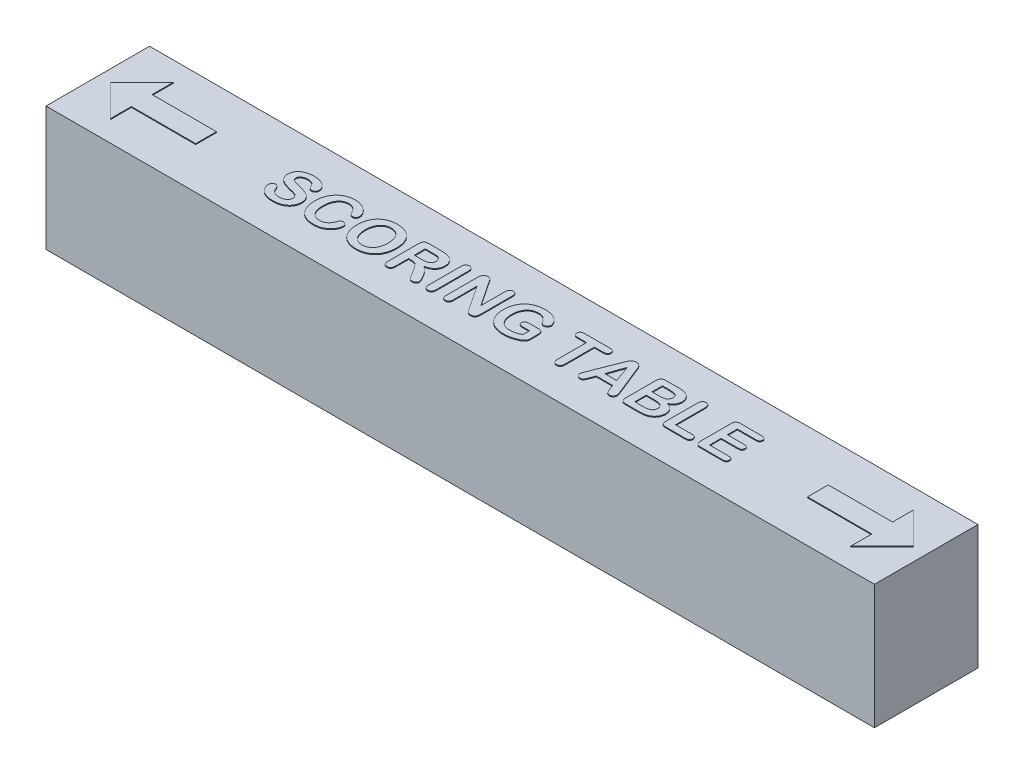
from build123d import *

# Parameters (mm, degrees)
SKETCH1_W              = 6096
SKETCH1_H              = 762
BOSS_EXTRUDE1_DEPTH    = 914.4
BOSS_EXTRUDE2_DEPTH    = 6.35
BOSS_EXTRUDE2_2_DEPTH  = 6.35
BOSS_EXTRUDE2_3_DEPTH  = 6.35
BOSS_EXTRUDE2_4_DEPTH  = 6.35
BOSS_EXTRUDE2_5_DEPTH  = 6.35
BOSS_EXTRUDE2_6_DEPTH  = 6.35
BOSS_EXTRUDE2_7_DEPTH  = 6.35
BOSS_EXTRUDE2_8_DEPTH  = 6.35
BOSS_EXTRUDE2_9_DEPTH  = 6.35
BOSS_EXTRUDE2_10_DEPTH = 6.35
BOSS_EXTRUDE2_11_DEPTH = 6.35
BOSS_EXTRUDE2_12_DEPTH = 6.35
BOSS_EXTRUDE3_DEPTH    = 6.35


with BuildPart() as part:
    # Sketch1 → Boss-Extrude1 (new body)
    with BuildSketch(Plane(origin=(0, 0, 0), x_dir=(1, 0, 0), z_dir=(0, 1, 0))):
        Rectangle(SKETCH1_W, SKETCH1_H)
    extrude(amount=BOSS_EXTRUDE1_DEPTH)


with BuildPart() as body_2:
    # Sketch2 → Boss-Extrude2 (new body)
    with BuildSketch(Plane(origin=(0, 914.4, 0), x_dir=(1, 0, 0), z_dir=(0, 1, 0))):
        with BuildLine():
            add(Edge.make_bspline(
                [(-1487.056518555, -60.121112251), (-1487.106101545, -62.390065609), (-1487.204161535, -66.877361336), (-1487.884416786, -73.513910098), (-1488.966104006, -79.968876731), (-1490.455928384, -86.256782548), (-1492.460404312, -92.344775869), (-1494.891754339, -98.268986087), (-1497.683891782, -104.057643313), (-1501.042436703, -109.597594048), (-1504.725550212, -114.935890286), (-1508.876147346, -119.96561222), (-1513.362092894, -124.736522709), (-1518.358376203, -129.133952677), (-1523.701553024, -133.282213676), (-1529.44640812, -137.154974802), (-1535.605669055, -140.704068395), (-1542.155179848, -143.951549975), (-1549.078391402, -146.830093093), (-1556.317213861, -149.346711063), (-1563.853392888, -151.567280221), (-1571.743869654, -153.165352674), (-1579.901538273, -154.616664147), (-1588.408780852, -155.529461745), (-1597.223485866, -156.169642078), (-1603.21151486, -156.22463932), (-1606.242557526, -156.252478027)],
                knots=[0, 0, 0, 0, 0.94904565, 1.876922008, 2.787632434, 3.685409961, 4.577243309, 5.465673456, 6.362823001, 7.262481841, 8.172882791, 9.073480814, 9.987781212, 10.909257821, 11.854472834, 12.815908446, 13.804938933, 14.825933836, 15.871877953, 16.938992789, 18.030809531, 19.155177508, 20.304610591, 21.495671913, 22.732349945, 24, 24, 24, 24], degree=3))
            add(Edge.make_bspline(
                [(-1606.242557526, -156.252478027), (-1609.855253209, -156.184433599), (-1616.948597707, -156.050831821), (-1627.347499347, -155.306444563), (-1637.246749066, -153.884081723), (-1646.692001381, -152.057012172), (-1655.64758092, -149.599092551), (-1664.095686416, -146.553464511), (-1672.122487261, -143.123746698), (-1677.096867585, -140.269478871), (-1679.560029984, -138.856131935)],
                knots=[0, 0, 0, 0, 1.136969792, 2.232382444, 3.278022597, 4.282276305, 5.258039159, 6.196692155, 7.1070566, 8, 8, 8, 8], degree=3))
            add(Edge.make_bspline(
                [(-1679.560029984, -138.856131935), (-1682.752348382, -136.75073427), (-1689.104158979, -132.561588473), (-1697.531716836, -124.815610774), (-1705.200794944, -116.262933255), (-1711.70605, -106.782460892), (-1717.034440691, -96.91527189), (-1720.955479696, -86.989030774), (-1723.370331376, -77.15080032), (-1723.701453991, -70.6074513), (-1723.863527298, -67.404703522)],
                knots=[0, 0, 0, 0, 1.048405233, 2.086029851, 3.131870059, 4.19698972, 5.234628962, 6.204463721, 7.121145791, 8, 8, 8, 8], degree=3))
            add(Edge.make_bspline(
                [(-1723.863527298, -67.404703522), (-1723.771997221, -65.609520864), (-1723.59323326, -62.103416949), (-1722.158540448, -57.067597685), (-1719.809958909, -52.465881566), (-1716.650496166, -48.316773205), (-1712.691215521, -44.893606301), (-1708.143814099, -42.377845068), (-1703.079380081, -40.788879209), (-1699.51665912, -40.636405633), (-1697.678715706, -40.557747269)],
                knots=[0, 0, 0, 0, 1.029346977, 2.010378973, 2.978887221, 3.98112847, 4.985683985, 5.960201932, 6.947705008, 8, 8, 8, 8], degree=3))
            add(Edge.make_bspline(
                [(-1697.678715706, -40.557747269), (-1696.185371322, -40.615741667), (-1693.291226601, -40.728136493), (-1689.136492526, -41.939019956), (-1685.356760741, -43.885545459), (-1681.936539275, -46.629447951), (-1678.781733164, -50.029731756), (-1675.96152068, -54.223993064), (-1673.294432387, -59.083422524), (-1671.874552172, -62.690840666), (-1671.132734299, -64.57553997)],
                knots=[0, 0, 0, 0, 0.932433643, 1.807083439, 2.683354794, 3.577798377, 4.537574086, 5.575745438, 6.73344572, 8, 8, 8, 8], degree=3))
            add(Edge.make_bspline(
                [(-1671.132734299, -64.57553997), (-1670.146705697, -66.85034275), (-1668.243537119, -71.241019821), (-1665.202983078, -77.490499585), (-1661.90390367, -83.069434815), (-1658.628653722, -88.250735802), (-1654.82274405, -92.896590475), (-1650.298748889, -96.983616691), (-1645.150554256, -100.745047376), (-1639.267407594, -104.087897101), (-1632.537660748, -106.849164633), (-1624.814080893, -108.620458967), (-1616.216112392, -109.881549919), (-1610.140501456, -109.974275718), (-1606.964897156, -110.022741699)],
                knots=[0, 0, 0, 0, 1.049400523, 2.025484958, 2.938775158, 3.791458515, 4.617854192, 5.471340711, 6.364831691, 7.311813007, 8.329001391, 9.430967745, 10.65721654, 12, 12, 12, 12], degree=3))
            add(Edge.make_bspline(
                [(-1606.964897156, -110.022741699), (-1604.715946839, -109.995585102), (-1600.309856742, -109.942380542), (-1593.87935511, -109.30671697), (-1587.753780811, -108.38245443), (-1581.99886016, -106.96015024), (-1576.505141631, -105.325627474), (-1571.396747221, -103.114826424), (-1566.568225954, -100.609173348), (-1562.117467268, -97.720606628), (-1558.086431767, -94.537028432), (-1554.526103143, -91.135609354), (-1551.541256632, -87.490198621), (-1549.12700917, -83.65701207), (-1547.143887444, -79.686203507), (-1545.860558315, -75.46984034), (-1544.93857011, -71.096641245), (-1544.875702549, -68.09200346), (-1544.843688965, -66.561973953)],
                knots=[0, 0, 0, 0, 1.280104897, 2.507951138, 3.676307556, 4.80418709, 5.881088807, 6.935759984, 7.968101261, 8.975871649, 9.951925376, 10.889226907, 11.77430911, 12.626938706, 13.464975202, 14.292430499, 15.130466995, 16, 16, 16, 16], degree=3))
            add(Edge.make_bspline(
                [(-1544.843688965, -66.561973953), (-1544.952978111, -64.202111722), (-1545.163649715, -59.65311504), (-1546.961053189, -53.200720418), (-1549.892183072, -47.429210371), (-1554.104675319, -42.492593387), (-1559.152808618, -38.171446869), (-1564.892851072, -34.361952805), (-1571.350519751, -31.187051563), (-1578.543730767, -28.454775266), (-1586.713346077, -26.040250049), (-1595.96395001, -23.410295356), (-1606.507388448, -20.884241296), (-1613.946055641, -19.18154536), (-1617.860186577, -18.285608673)],
                knots=[0, 0, 0, 0, 0.889216893, 1.714102054, 2.506617733, 3.313297162, 4.145346194, 5.008548814, 5.905982136, 6.85524107, 7.90915739, 9.119934543, 10.484546625, 12, 12, 12, 12], degree=3))
            add(Edge.make_bspline(
                [(-1617.860186577, -18.285608673), (-1622.988500488, -17.025984756), (-1632.857980968, -14.601828615), (-1646.903293679, -10.391098261), (-1659.639029147, -5.869918334), (-1671.213064187, -1.121843012), (-1681.566130108, 4.36725648), (-1690.787770249, 10.722309608), (-1698.81344083, 18.054644142), (-1704.651995525, 24.861143489), (-1708.574551827, 30.803675673), (-1711.196298241, 35.51340875), (-1713.353422141, 40.520078507), (-1715.091643768, 45.784779662), (-1716.474505755, 51.277733407), (-1717.509684458, 57.026145451), (-1718.117398296, 63.044580138), (-1718.175596722, 67.149731693), (-1718.205200195, 69.237876511)],
                knots=[0, 0, 0, 0, 1.736501148, 3.341910126, 4.819600125, 6.179978285, 7.452384316, 8.666026066, 9.852526874, 11.018500134, 11.604160195, 12.191898388, 12.788898658, 13.394048862, 14.013423104, 14.650267458, 15.313438986, 16, 16, 16, 16], degree=3))
            add(Edge.make_bspline(
                [(-1718.205200195, 69.237876511), (-1718.183704342, 71.246882416), (-1718.141233304, 75.216232463), (-1717.403541535, 81.079890274), (-1716.455103107, 86.796478425), (-1714.881310226, 92.305764551), (-1713.043949244, 97.673161757), (-1710.757476071, 102.88546051), (-1707.952965829, 107.859762387), (-1704.846858609, 112.704016646), (-1701.269621715, 117.267535744), (-1697.3476866, 121.633139548), (-1693.016693202, 125.717066898), (-1688.3110598, 129.495911365), (-1683.28581882, 133.032508973), (-1677.831837999, 136.21537666), (-1672.006290104, 139.13343857), (-1663.694381978, 142.834899311), (-1652.42426505, 146.517934675), (-1637.952133346, 149.717918606), (-1622.341931598, 151.561769343), (-1611.564632253, 151.815036669), (-1606.001777649, 151.94576416)],
                knots=[0, 0, 0, 0, 0.769447055, 1.520256708, 2.262508943, 2.988321943, 3.713156319, 4.436274914, 5.166110871, 5.89994773, 6.639925254, 7.385953261, 8.147635144, 8.918771606, 9.697541001, 10.500837489, 11.336648996, 12.194084557, 13.986552036, 15.869357873, 17.867910982, 20, 20, 20, 20], degree=3))
            add(Edge.make_bspline(
                [(-1606.001777649, 151.94576416), (-1601.564135532, 151.871310428), (-1592.99066099, 151.727466656), (-1580.593101928, 150.445257203), (-1569.126803001, 148.382911535), (-1558.588917053, 145.437640057), (-1549.003788186, 141.688952849), (-1540.138682813, 137.626534844), (-1532.24253247, 132.75501459), (-1525.180161811, 127.461297573), (-1519.009915252, 121.837359227), (-1513.712219865, 116.009639697), (-1509.276019269, 110.060180243), (-1505.794944047, 103.94398912), (-1503.054557725, 97.858184116), (-1501.113035623, 91.803485572), (-1499.900182201, 85.800137647), (-1499.764438964, 81.803946306), (-1499.697462082, 79.832191086)],
                knots=[0, 0, 0, 0, 1.501690988, 2.90125006, 4.213360721, 5.441058994, 6.597662568, 7.694391675, 8.736870916, 9.731158549, 10.678212085, 11.558107852, 12.393499291, 13.184506524, 13.935459515, 14.648542639, 15.3331793, 16, 16, 16, 16], degree=3))
            add(Edge.make_bspline(
                [(-1499.697462082, 79.832191086), (-1499.79153981, 78.077237785), (-1499.977323597, 74.611572997), (-1501.427251065, 69.557962339), (-1503.81985076, 64.822459558), (-1507.040591437, 60.473265772), (-1510.930043017, 56.745637019), (-1515.450702045, 54.025720738), (-1520.444437015, 52.30601654), (-1523.96208953, 52.118207264), (-1525.761883736, 52.022115326)],
                knots=[0, 0, 0, 0, 0.996822281, 1.968514991, 2.963507279, 3.999520829, 5.032703306, 6.005199511, 6.979367534, 8, 8, 8, 8], degree=3))
            add(Edge.make_bspline(
                [(-1525.761883736, 52.022115326), (-1527.351425255, 52.076907905), (-1530.354760794, 52.180434926), (-1534.562504367, 53.021908521), (-1538.197837434, 54.383062369), (-1541.307483551, 56.431780891), (-1544.064009235, 59.158284468), (-1546.80122299, 62.523946035), (-1549.785419626, 66.475352963), (-1551.630937785, 69.46145264), (-1552.608839989, 71.043725586)],
                knots=[0, 0, 0, 0, 1.091449335, 2.062222683, 2.935356023, 3.742291246, 4.60049062, 5.589116983, 6.722522559, 8, 8, 8, 8], degree=3))
            add(Edge.make_bspline(
                [(-1552.608839989, 71.043725586), (-1554.019462617, 73.941718141), (-1556.741393639, 79.533671423), (-1561.572036442, 87.188685192), (-1566.910371223, 93.76813853), (-1571.68628649, 98.604345497), (-1575.898436429, 101.9326839), (-1579.573943053, 103.963745906), (-1583.660065993, 105.679767736), (-1588.15993293, 107.158734635), (-1593.128522217, 108.205705739), (-1598.538148225, 108.975952644), (-1604.387988793, 109.460341259), (-1608.428689762, 109.531658402), (-1610.516400337, 109.568505859)],
                knots=[0, 0, 0, 0, 1.547925219, 2.986869477, 4.337480217, 5.612327564, 6.244828973, 6.909713596, 7.622436063, 8.372459485, 9.181850378, 10.058552105, 10.996911345, 12, 12, 12, 12], degree=3))
            add(Edge.make_bspline(
                [(-1610.516400337, 109.568505859), (-1614.35593569, 109.441195122), (-1621.683211139, 109.198238422), (-1632.135567578, 107.376564386), (-1641.398225846, 104.10580239), (-1648.19679625, 100.332348984), (-1652.940932463, 96.865309222), (-1655.931024142, 94.085385961), (-1658.532896887, 91.247662687), (-1660.57757773, 88.20457749), (-1662.214860083, 85.055922831), (-1663.47299828, 81.779220696), (-1664.109488447, 78.331847782), (-1664.216808192, 76.001863662), (-1664.270507812, 74.836008644)],
                knots=[0, 0, 0, 0, 1.954508865, 3.729936959, 5.377867423, 6.932763574, 7.670377485, 8.364471239, 9.008409927, 9.626125187, 10.224705099, 10.812996495, 11.406058616, 12, 12, 12, 12], degree=3))
            add(Edge.make_bspline(
                [(-1664.270507812, 74.836008644), (-1664.219461914, 73.405768264), (-1664.119013806, 70.591341569), (-1663.127523761, 66.540752772), (-1661.526347162, 62.788357778), (-1659.341655374, 59.324681575), (-1656.54203552, 56.192412734), (-1653.212834393, 53.384764255), (-1649.576732846, 50.622812012), (-1643.979890675, 47.497967941), (-1636.686749772, 44.083348745), (-1628.873749895, 41.372469676), (-1621.82381463, 39.480388851), (-1615.090375032, 37.759434142), (-1606.922046955, 35.619964451), (-1600.968472841, 34.192392994), (-1597.755066872, 33.42186985)],
                knots=[0, 0, 0, 0, 0.710476229, 1.398074961, 2.059979244, 2.732930957, 3.425942516, 4.140543967, 4.897202213, 5.693324271, 7.323324828, 8.898613798, 9.799484583, 10.954336094, 12.356121149, 14, 14, 14, 14], degree=3))
            add(Edge.make_bspline(
                [(-1597.755066872, 33.42186985), (-1593.657298507, 32.436589934), (-1585.641053265, 30.509139495), (-1573.935503242, 27.373113365), (-1562.825202689, 24.09137322), (-1552.321932609, 20.589013614), (-1542.46602848, 16.944010184), (-1533.388277806, 12.81513379), (-1525.049662767, 8.386781847), (-1517.448353426, 3.514471652), (-1510.652096568, -1.954380927), (-1504.54467406, -7.975219498), (-1499.360934435, -14.79559311), (-1494.928062895, -22.252635908), (-1491.298174818, -30.468491456), (-1488.814983634, -39.594317844), (-1487.292918267, -49.575685221), (-1487.137163106, -56.523683051), (-1487.056518555, -60.121112251)],
                knots=[0, 0, 0, 0, 1.267502217, 2.479546844, 3.644246111, 4.751070339, 5.809111578, 6.802976886, 7.747931384, 8.64678748, 9.513844361, 10.367269951, 11.219414442, 12.082556445, 12.971635876, 13.911644553, 14.918722911, 16, 16, 16, 16], degree=3))
        make_face()
    extrude(amount=BOSS_EXTRUDE2_DEPTH)


with BuildPart() as body_3:
    # Sketch2 → Boss-Extrude2 2 (new body)
    with BuildSketch(Plane(origin=(0, 914.4, 0), x_dir=(1, 0, 0), z_dir=(0, 1, 0))):
        with BuildLine():
            add(Edge.make_bspline(
                [(-1182.530169487, -57.954093361), (-1182.611931916, -60.347578678), (-1182.780748806, -65.289466478), (-1184.200515189, -72.806880437), (-1186.374873209, -80.628279579), (-1189.466556643, -88.662801309), (-1193.392958871, -96.858145341), (-1198.482915274, -104.95973777), (-1204.506602821, -113.024415785), (-1211.519197678, -120.951970372), (-1219.533077421, -128.477176956), (-1228.692600395, -135.276664589), (-1238.867199957, -141.321815818), (-1250.043721381, -146.64696045), (-1262.21556734, -151.025475854), (-1275.453006864, -154.035011207), (-1289.621062941, -155.948813885), (-1299.402253485, -156.149449731), (-1304.424982071, -156.252478027)],
                knots=[0, 0, 0, 0, 0.663733519, 1.370426865, 2.116139696, 2.914458905, 3.756161797, 4.633801399, 5.564768272, 6.546895284, 7.567232022, 8.609557965, 9.705783212, 10.846455846, 12.040496113, 13.287086875, 14.606894913, 16, 16, 16, 16], degree=3))
            add(Edge.make_bspline(
                [(-1304.424982071, -156.252478027), (-1308.259320688, -156.220260155), (-1315.757312667, -156.157258586), (-1326.742944663, -155.254812771), (-1337.217938057, -153.971973918), (-1347.181458873, -152.127189797), (-1356.652088265, -149.63557561), (-1365.660840941, -146.571794646), (-1374.278842099, -142.965514804), (-1382.435833958, -138.675400911), (-1390.211421501, -133.676734765), (-1397.654977244, -128.020786511), (-1404.84298197, -121.680138731), (-1409.224086117, -116.944948758), (-1411.451637268, -114.537364388)],
                knots=[0, 0, 0, 0, 1.162398207, 2.273052359, 3.340187725, 4.361698781, 5.343118899, 6.307107414, 7.245071305, 8.173155143, 9.098082292, 10.044846171, 11.00591152, 12, 12, 12, 12], degree=3))
            add(Edge.make_bspline(
                [(-1411.451637268, -114.537364388), (-1413.386125833, -112.131381842), (-1417.263544764, -107.308917424), (-1422.599325849, -99.634271913), (-1427.356529332, -91.470876975), (-1431.877812201, -83.009850474), (-1435.738019575, -74.085613023), (-1439.18128549, -64.89234659), (-1442.096015273, -55.387884583), (-1444.403488902, -45.56636833), (-1446.317829368, -35.471595892), (-1447.505500022, -25.04754996), (-1448.435311887, -14.369511636), (-1448.499389175, -7.131646922), (-1448.531738281, -3.477646255)],
                knots=[0, 0, 0, 0, 0.929575355, 1.863207229, 2.811429804, 3.773642551, 4.750392879, 5.73698116, 6.729013264, 7.741753443, 8.774044155, 9.821085133, 10.899985467, 12, 12, 12, 12], degree=3))
            add(Edge.make_bspline(
                [(-1448.531738281, -3.477646255), (-1448.413393007, 2.407705428), (-1448.182453151, 13.892424824), (-1446.129703546, 30.621330864), (-1442.946805519, 46.441813542), (-1438.289402506, 61.267244068), (-1432.422782852, 75.124950282), (-1425.476630936, 87.997512827), (-1417.25371303, 99.770827474), (-1407.996929471, 110.487156758), (-1397.73532329, 120.078479517), (-1386.628015816, 128.487625664), (-1374.672117907, 135.634838558), (-1361.957628175, 141.533561794), (-1348.61006334, 146.124775257), (-1334.803321152, 149.54929093), (-1320.556892482, 151.565745175), (-1310.9122464, 151.818398239), (-1306.050246239, 151.94576416)],
                knots=[0, 0, 0, 0, 1.192086909, 2.32624733, 3.409866705, 4.457877143, 5.469000883, 6.455088314, 7.416011801, 8.372962001, 9.319325461, 10.256879636, 11.190511563, 12.136385829, 13.091719595, 14.046248446, 15.015086683, 16, 16, 16, 16], degree=3))
            add(Edge.make_bspline(
                [(-1306.050246239, 151.94576416), (-1303.079547073, 151.894879133), (-1297.211075184, 151.794358233), (-1288.526520293, 151.135255257), (-1280.089689361, 149.981451896), (-1271.891514149, 148.415395514), (-1263.937191785, 146.456524718), (-1256.243815046, 143.957118992), (-1248.801622524, 141.028209205), (-1241.654843394, 137.631951961), (-1234.813350747, 133.993679942), (-1228.380646369, 130.067845586), (-1222.325108023, 125.986374165), (-1216.714449039, 121.621757526), (-1211.480034716, 117.08788332), (-1206.717717924, 112.281196995), (-1202.279548582, 107.362320862), (-1198.359369008, 102.186895593), (-1194.80268742, 97.006205686), (-1191.791539661, 91.790635363), (-1189.213962034, 86.680472204), (-1186.976331298, 81.673284143), (-1185.373667767, 76.677954122), (-1184.228848841, 71.763896568), (-1183.452584495, 66.934830585), (-1183.358981079, 63.722853297), (-1183.312704086, 62.134870148)],
                knots=[0, 0, 0, 0, 1.284700242, 2.537862918, 3.763812693, 4.965289083, 6.145935712, 7.303948861, 8.460888676, 9.602102237, 10.724019168, 11.810373379, 12.859709494, 13.88027226, 14.88267171, 15.852117704, 16.804758353, 17.745428632, 18.657571087, 19.520770973, 20.347343408, 21.132381758, 21.889741149, 22.611674871, 23.313620019, 24, 24, 24, 24], degree=3))
            add(Edge.make_bspline(
                [(-1183.312704086, 62.134870148), (-1183.413945064, 60.462016177), (-1183.61358416, 57.163282206), (-1184.953297149, 52.334955401), (-1187.39700646, 47.918388939), (-1190.532567648, 43.858749343), (-1194.336306412, 40.442132163), (-1198.628766001, 37.919896039), (-1203.326460367, 36.309785449), (-1206.61523057, 36.151319668), (-1208.293616295, 36.070448494)],
                knots=[0, 0, 0, 0, 1.005202555, 1.982178884, 2.979908251, 4.019228851, 5.052378826, 6.030321538, 6.994797445, 8, 8, 8, 8], degree=3))
            add(Edge.make_bspline(
                [(-1208.293616295, 36.070448494), (-1210.104029035, 36.138708979), (-1213.536359118, 36.268122847), (-1218.34566672, 37.251176612), (-1222.434183093, 39.009613609), (-1225.901557811, 41.578015417), (-1228.878927536, 45.123893431), (-1231.987749259, 49.466848434), (-1235.305739166, 54.796199733), (-1237.431783923, 58.75058787), (-1238.571685791, 60.870775795)],
                knots=[0, 0, 0, 0, 1.03602979, 1.964190893, 2.792215287, 3.564084538, 4.410155262, 5.430272824, 6.62221301, 8, 8, 8, 8], degree=3))
            add(Edge.make_bspline(
                [(-1238.571685791, 60.870775795), (-1240.544275823, 64.42756875), (-1244.349797621, 71.289335715), (-1251.061822418, 80.49715841), (-1258.305153832, 88.278212109), (-1266.113866999, 94.70509739), (-1274.725513959, 99.681418982), (-1284.204587977, 103.268543799), (-1294.647930597, 105.300717889), (-1301.888019573, 105.574544899), (-1305.628881454, 105.716027832)],
                knots=[0, 0, 0, 0, 1.14083101, 2.200891824, 3.189077095, 4.117958574, 5.028926365, 5.968284059, 6.950238216, 8, 8, 8, 8], degree=3))
            add(Edge.make_bspline(
                [(-1305.628881454, 105.716027832), (-1308.644872627, 105.649910896), (-1314.569895563, 105.520021802), (-1323.199776903, 104.059395679), (-1331.382249025, 101.885427728), (-1339.063721482, 98.679071382), (-1346.308932687, 94.669092981), (-1353.045314525, 89.667297382), (-1359.273158604, 83.75954253), (-1365.055138641, 77.025321914), (-1370.226195625, 69.436424682), (-1374.672972926, 61.062169296), (-1378.503451084, 51.987956239), (-1381.512260981, 42.10678236), (-1384.032874624, 31.504655059), (-1385.635294323, 20.097846323), (-1386.689851463, 7.979330481), (-1386.823456651, -0.34508534), (-1386.892089844, -4.62135067)],
                knots=[0, 0, 0, 0, 0.93671651, 1.840213212, 2.713397844, 3.56368846, 4.421020421, 5.281885359, 6.164466969, 7.084649485, 8.036264718, 9.013062724, 10.027939462, 11.093339593, 12.220621858, 13.412469407, 14.670781518, 16, 16, 16, 16], degree=3))
            add(Edge.make_bspline(
                [(-1386.892089844, -4.62135067), (-1386.847891584, -7.511067507), (-1386.761597872, -13.153017997), (-1386.365379856, -21.450082963), (-1385.583512518, -29.363229711), (-1384.479164889, -36.907657847), (-1383.197820367, -44.09550142), (-1381.508096087, -50.885831967), (-1379.50169043, -57.31064723), (-1377.257376174, -63.382347594), (-1374.606852869, -69.045903538), (-1371.894847734, -74.425236373), (-1368.821505592, -79.387111009), (-1365.397772386, -83.889474159), (-1361.869743021, -88.154352977), (-1358.01776898, -91.998937185), (-1353.896098857, -95.445584109), (-1348.107971884, -99.54805814), (-1340.26696288, -103.779280466), (-1330.082616501, -107.415353224), (-1319.12809411, -109.637721223), (-1311.558690824, -109.892194391), (-1307.675510406, -110.022741699)],
                knots=[0, 0, 0, 0, 1.161576005, 2.267888061, 3.337585273, 4.356077319, 5.33204537, 6.270922222, 7.166254778, 8.036538097, 8.870177389, 9.678142996, 10.45692397, 11.2117863, 11.950096439, 12.68003429, 13.395618977, 14.107193223, 15.528992878, 16.960094082, 18.440497528, 20, 20, 20, 20], degree=3))
            add(Edge.make_bspline(
                [(-1307.675510406, -110.022741699), (-1305.546449547, -110.000535005), (-1301.35761551, -109.956844306), (-1295.228714082, -109.243159196), (-1289.327362105, -108.245281793), (-1283.700625434, -106.788199543), (-1278.277824727, -105.00898129), (-1273.172647136, -102.681557792), (-1268.262900002, -100.040422335), (-1263.616972046, -96.97271055), (-1259.278673049, -93.448366326), (-1255.181300788, -89.580291254), (-1251.290449445, -85.387236854), (-1247.825655415, -80.69574533), (-1244.546274843, -75.683075222), (-1241.553489956, -70.270230194), (-1238.82461413, -64.483246654), (-1237.299919348, -60.433548346), (-1236.525056839, -58.375458145)],
                knots=[0, 0, 0, 0, 1.080453892, 2.125745732, 3.129130718, 4.117609764, 5.07455133, 6.023212249, 6.962414916, 7.903439618, 8.845456672, 9.796903999, 10.763291339, 11.745501622, 12.754406698, 13.803416246, 14.883677954, 16, 16, 16, 16], degree=3))
            add(Edge.make_bspline(
                [(-1236.525056839, -58.375458145), (-1235.871771157, -56.458430933), (-1234.609742373, -52.755084005), (-1232.321326767, -47.586430706), (-1229.835317966, -42.973302473), (-1227.182792026, -38.821454486), (-1223.808610945, -35.363931262), (-1219.513561135, -32.899957065), (-1214.353629917, -31.538211952), (-1210.669512304, -31.374549626), (-1208.714981079, -31.287722015)],
                knots=[0, 0, 0, 0, 1.148264852, 2.218238262, 3.200956292, 4.119438462, 5.004604087, 5.912235567, 6.892380428, 8, 8, 8, 8], degree=3))
            add(Edge.make_bspline(
                [(-1208.714981079, -31.287722015), (-1206.977672497, -31.374069387), (-1203.56035809, -31.543916078), (-1198.663520989, -33.082238184), (-1194.093935838, -35.434291245), (-1190.139636296, -38.838962125), (-1186.73249814, -42.817607261), (-1184.285647399, -47.439158503), (-1182.782545959, -52.544231823), (-1182.615842655, -56.117630656), (-1182.530169487, -57.954093361)],
                knots=[0, 0, 0, 0, 1.000050397, 1.967115494, 2.935635085, 3.946684534, 4.957733984, 5.941906876, 6.942292355, 8, 8, 8, 8], degree=3))
        make_face()
    extrude(amount=BOSS_EXTRUDE2_2_DEPTH)


with BuildPart() as body_4:
    # Sketch2 → Boss-Extrude2 3 (new body)
    with BuildSketch(Plane(origin=(0, 914.4, 0), x_dir=(1, 0, 0), z_dir=(0, 1, 0))):
        with BuildLine():
            add(Edge.make_bspline(
                [(-994.962645531, 151.94576416), (-991.148227008, 151.892217238), (-983.668877315, 151.787221901), (-972.659969524, 150.835467638), (-962.042403851, 149.422773268), (-951.823368553, 147.389356897), (-942.028214475, 144.736043657), (-932.655076338, 141.475075589), (-923.691875919, 137.617253841), (-915.128130419, 133.238267492), (-907.057913133, 128.281269497), (-899.429841513, 122.860535773), (-892.330317152, 116.896541046), (-885.742790773, 110.441637198), (-879.709291972, 103.478211779), (-874.142106291, 96.044928617), (-869.084118649, 88.09997421), (-864.589805034, 79.645036778), (-860.551967997, 70.806449966), (-857.046855277, 61.558309175), (-854.121349298, 51.939794572), (-851.687959329, 41.934973265), (-849.843695906, 31.558488381), (-848.544625751, 20.78603813), (-847.645275557, 9.660112402), (-847.578859966, 2.102257759), (-847.545166016, -1.731992149)],
                knots=[0, 0, 0, 0, 1.137132438, 2.22970057, 3.292424762, 4.329649132, 5.333981859, 6.315987487, 7.286185149, 8.241436353, 9.181332131, 10.107725602, 11.0292572, 11.943085262, 12.854854597, 13.773819033, 14.709898734, 15.660115542, 16.626635295, 17.605574315, 18.606712189, 19.622473761, 20.67399022, 21.747038223, 22.857027702, 24, 24, 24, 24], degree=3))
            add(Edge.make_bspline(
                [(-847.545166016, -1.731992149), (-847.662752383, -7.354457421), (-847.893470573, -18.386391143), (-849.643542826, -34.536942116), (-852.610258847, -49.910865802), (-856.650705534, -64.501925927), (-861.961341011, -78.209107389), (-868.42230342, -91.014409208), (-876.097156289, -102.856021739), (-884.903214513, -113.72324017), (-894.806806132, -123.55450603), (-905.875591526, -132.125106221), (-918.040930164, -139.44013082), (-931.19475955, -145.601721724), (-945.415864795, -150.456341963), (-960.675451304, -153.720127501), (-976.879267925, -155.941498573), (-988.032289542, -156.146976523), (-993.758746147, -156.252478027)],
                knots=[0, 0, 0, 0, 1.119700056, 2.196982321, 3.230778928, 4.235358115, 5.208318876, 6.153781848, 7.087131445, 8.013361148, 8.934611457, 9.860297843, 10.794468433, 11.756326826, 12.748403726, 13.780058436, 14.860183413, 16, 16, 16, 16], degree=3))
            add(Edge.make_bspline(
                [(-993.758746147, -156.252478027), (-999.443944213, -156.115602239), (-1010.573751096, -155.847643044), (-1026.798369126, -153.70042), (-1042.139179863, -150.246305319), (-1056.508595386, -145.30756641), (-1069.806243258, -139.018300452), (-1082.087880628, -131.697622246), (-1093.11522916, -123.049532167), (-1103.029933204, -113.320884033), (-1111.831202668, -102.496334006), (-1119.313662658, -90.522231069), (-1125.91258187, -77.659187363), (-1131.128584672, -63.71640759), (-1135.278472127, -48.9963763), (-1138.20323602, -33.608816702), (-1139.986512772, -17.645569828), (-1140.21661374, -6.813100841), (-1140.333496094, -1.310627365)],
                knots=[0, 0, 0, 0, 1.130091603, 2.212359386, 3.247930852, 4.252250901, 5.226719473, 6.16821431, 7.089197795, 8.00610207, 8.925165125, 9.855999165, 10.808795857, 11.79501972, 12.810514548, 13.846493258, 14.906102224, 16, 16, 16, 16], degree=3))
            add(Edge.make_bspline(
                [(-1140.333496094, -1.310627365), (-1140.227471661, 4.293053554), (-1140.018989689, 15.311895237), (-1138.094167138, 31.455603517), (-1135.055137311, 46.911452513), (-1130.723498783, 61.601632481), (-1125.231353615, 75.422944354), (-1118.565043741, 88.224658404), (-1110.846857648, 99.967094088), (-1102.02572108, 110.627903379), (-1092.087625944, 120.142180809), (-1081.088171089, 128.462868703), (-1069.081500009, 135.620423183), (-1056.067060986, 141.507624961), (-1042.104064817, 146.232881211), (-1027.196142983, 149.569054529), (-1011.371323362, 151.590157367), (-1000.526810707, 151.825178275), (-994.962645531, 151.94576416)],
                knots=[0, 0, 0, 0, 1.125218611, 2.212582392, 3.260701818, 4.286054269, 5.284468473, 6.243521648, 7.180287843, 8.101949555, 9.017004541, 9.937572836, 10.866572707, 11.818894766, 12.801573564, 13.82236102, 14.882684417, 16, 16, 16, 16], degree=3))
        make_face()
        with BuildLine():
            add(Edge.make_bspline(
                [(-909.184814453, -1.310627365), (-909.302528385, 4.053366172), (-909.530449838, 14.439300788), (-911.550465473, 29.463319771), (-914.822266949, 43.398837855), (-918.72184612, 54.189135578), (-922.466406756, 62.187412995), (-925.524582162, 67.754237858), (-928.8142787, 72.995138377), (-932.548011634, 77.735506965), (-936.421036866, 82.20147538), (-940.614278092, 86.287731542), (-945.135040009, 89.933432333), (-951.470140084, 94.358411401), (-960.001399053, 98.943467202), (-971.01660554, 102.872379233), (-982.758405655, 105.293530606), (-990.837594731, 105.573223156), (-994.962645531, 105.716027832)],
                knots=[0, 0, 0, 0, 1.663767962, 3.22144036, 4.693807908, 6.09809827, 6.772124886, 7.43249818, 8.068074837, 8.689496673, 9.30272399, 9.901527182, 10.503429657, 11.102750509, 12.297797107, 13.495176895, 14.721094103, 16, 16, 16, 16], degree=3))
            add(Edge.make_bspline(
                [(-994.962645531, 105.716027832), (-997.917478498, 105.642525724), (-1003.757423994, 105.497255819), (-1012.330253276, 104.11764201), (-1020.565266264, 101.960073769), (-1028.424149105, 98.942365726), (-1035.836912069, 95.0885978), (-1042.770393455, 90.409864985), (-1049.14098564, 84.924381499), (-1054.98434748, 78.654360011), (-1060.265559115, 71.536621177), (-1064.950977157, 63.497332262), (-1069.03337129, 54.536385158), (-1072.513768926, 44.73373639), (-1075.266422931, 34.139792844), (-1077.223699343, 22.865626687), (-1078.453257487, 10.976178291), (-1078.612458205, 2.845886496), (-1078.693847656, -1.310627365)],
                knots=[0, 0, 0, 0, 0.926902171, 1.831933723, 2.71800685, 3.595261319, 4.468550136, 5.334998465, 6.214894287, 7.1017058, 8.020008637, 8.99111482, 10.01694856, 11.106630737, 12.25237115, 13.448355624, 14.695502513, 16, 16, 16, 16], degree=3))
            add(Edge.make_bspline(
                [(-1078.693847656, -1.310627365), (-1078.612233531, -5.50719593), (-1078.452562558, -13.717419213), (-1077.225513887, -25.727518173), (-1075.25546064, -37.138549815), (-1072.522463579, -47.903286339), (-1068.986740223, -57.896229786), (-1064.742299631, -67.025814744), (-1059.984092153, -75.357161517), (-1054.370800423, -82.657964349), (-1048.307507672, -89.100567027), (-1041.791258113, -94.712031799), (-1034.869071975, -99.492408553), (-1027.474662356, -103.384095191), (-1019.648566836, -106.304074413), (-1011.477298226, -108.517041692), (-1002.907809213, -109.781026011), (-997.07344507, -109.941503307), (-994.119915962, -110.022741699)],
                knots=[0, 0, 0, 0, 1.300369924, 2.54406124, 3.737115199, 4.88637188, 5.981883645, 7.016846829, 8.003376514, 8.948590554, 9.863559023, 10.741055788, 11.608647785, 12.46534091, 13.323432129, 14.192248925, 15.0848625, 16, 16, 16, 16], degree=3))
            add(Edge.make_bspline(
                [(-994.119915962, -110.022741699), (-990.315836846, -109.895331885), (-982.820509742, -109.644291303), (-971.845368828, -107.300340195), (-961.359373719, -103.615020639), (-953.056739082, -99.371698572), (-946.799248996, -95.1917642), (-942.277364711, -91.665337957), (-938.073602302, -87.652433448), (-934.066650211, -83.307957286), (-930.353683909, -78.537178302), (-926.838264351, -73.400598692), (-923.592564647, -67.843305043), (-920.58972834, -61.896368181), (-917.877960088, -55.570606661), (-915.512670835, -48.882819807), (-913.627110657, -41.803607202), (-911.981444979, -34.398713505), (-910.729508006, -26.619431849), (-909.839257617, -18.503024246), (-909.281458306, -10.026657506), (-909.217529079, -4.261065062), (-909.184814453, -1.310627365)],
                knots=[0, 0, 0, 0, 1.468568495, 2.893578421, 4.316075305, 5.755382189, 6.482330971, 7.222315454, 7.968369796, 8.725783183, 9.504530818, 10.302500265, 11.129737207, 11.9897977, 12.875655565, 13.787998707, 14.728608307, 15.705132475, 16.718642732, 17.771954593, 18.859838044, 20, 20, 20, 20], degree=3))
        make_face(mode=Mode.SUBTRACT)
    extrude(amount=BOSS_EXTRUDE2_3_DEPTH)


with BuildPart() as body_5:
    # Sketch2 → Boss-Extrude2 4 (new body)
    with BuildSketch(Plane(origin=(0, 914.4, 0), x_dir=(1, 0, 0), z_dir=(0, 1, 0))):
        with BuildLine():
            Line((-714.995843887, -25.268225098), (-735.823303223, -25.268225098))
            Line((-735.823303223, -25.268225098), (-735.823303223, -119.894716644))
            add(Edge.make_bspline(
                [(-735.823303223, -119.894716644), (-735.896631612, -122.81155434), (-736.033833062, -128.269118042), (-737.521404267, -135.869481311), (-740.024822374, -142.279617857), (-743.562365607, -147.465367034), (-747.946254165, -151.394042154), (-752.947726306, -154.238430433), (-758.584618423, -155.979745584), (-762.55745741, -156.15997574), (-764.596498489, -156.252478027)],
                knots=[0, 0, 0, 0, 1.331902197, 2.492062242, 3.520752585, 4.456973203, 5.333663409, 6.188000262, 7.069999586, 8, 8, 8, 8], degree=3))
            add(Edge.make_bspline(
                [(-764.596498489, -156.252478027), (-766.775682223, -156.141889356), (-770.969752357, -155.929049732), (-776.876139861, -154.163009325), (-781.977090529, -151.173292469), (-786.28453777, -147.058842463), (-789.627110502, -141.740794841), (-791.929228096, -135.335711971), (-793.384102632, -127.905116187), (-793.532054585, -122.590980633), (-793.610473633, -119.774326706)],
                knots=[0, 0, 0, 0, 0.98783513, 1.901193439, 2.76656523, 3.649069121, 4.578809423, 5.590416226, 6.722847106, 8, 8, 8, 8], degree=3))
            Line((-793.610473633, -119.774326706), (-793.610473633, 107.582071877))
            add(Edge.make_bspline(
                [(-793.610473633, 107.582071877), (-793.522255334, 110.580463591), (-793.356725434, 116.206546703), (-791.75176481, 123.990077235), (-789.142028396, 130.526137374), (-785.282289486, 135.784030247), (-780.087162396, 139.70828365), (-773.634108009, 142.388105188), (-765.917626937, 143.988768878), (-760.351250553, 144.152961182), (-757.373102188, 144.240808105)],
                knots=[0, 0, 0, 0, 1.204539147, 2.260157444, 3.178834964, 4.014831347, 4.849268471, 5.763683293, 6.803515522, 8, 8, 8, 8], degree=3))
            Line((-757.373102188, 144.240808105), (-661.301931381, 144.240808105))
            add(Edge.make_bspline(
                [(-661.301931381, 144.240808105), (-658.111538704, 144.211578912), (-651.970065411, 144.155313014), (-643.093505278, 143.898812566), (-634.945852685, 143.27254993), (-627.431726895, 142.506343919), (-620.452302319, 141.479891567), (-613.909280236, 139.86254662), (-607.675298532, 137.940814639), (-603.760556284, 136.193803358), (-601.829301834, 135.331952667)],
                knots=[0, 0, 0, 0, 1.26312999, 2.431512321, 3.514756431, 4.497259456, 5.421894158, 6.30431173, 7.16346842, 8, 8, 8, 8], degree=3))
            add(Edge.make_bspline(
                [(-601.829301834, 135.331952667), (-599.518392603, 134.294628309), (-594.923379417, 132.232011984), (-588.442258892, 128.312309468), (-582.355910335, 123.817650002), (-576.763517346, 118.662509314), (-571.621748962, 113.061866381), (-567.239584945, 106.85020569), (-563.412742578, 100.279576161), (-560.285059876, 93.27087681), (-557.848391428, 85.944059521), (-555.99291115, 78.38444481), (-554.982964712, 70.589716328), (-554.832598446, 65.32783836), (-554.756835938, 62.67662487)],
                knots=[0, 0, 0, 0, 0.991101386, 1.970706541, 2.959125982, 3.949043219, 4.94477413, 5.930285116, 6.919453739, 7.918248778, 8.929482208, 9.939493973, 10.961807665, 12, 12, 12, 12], degree=3))
            add(Edge.make_bspline(
                [(-554.756835938, 62.67662487), (-554.810425533, 59.985085896), (-554.915122736, 54.726665841), (-555.853861654, 47.059436485), (-557.28350221, 39.785258852), (-559.288294092, 32.901691414), (-562.062950791, 26.485293207), (-565.282098998, 20.452976423), (-569.128261682, 14.834498257), (-573.593812283, 9.650997687), (-578.694168004, 4.895093658), (-584.350010049, 0.461085338), (-590.600043006, -3.631453563), (-597.510251176, -7.287071151), (-605.008098022, -10.620547268), (-613.140160724, -13.506068575), (-621.8305294, -16.230083846), (-627.902066046, -17.587610546), (-631.023861885, -18.285608673)],
                knots=[0, 0, 0, 0, 1.055142993, 2.061417327, 3.024364171, 3.960444909, 4.866579139, 5.760848635, 6.638237999, 7.530982974, 8.438346324, 9.368654669, 10.346405169, 11.363786046, 12.431180916, 13.561267985, 14.746079633, 16, 16, 16, 16], degree=3))
            add(Edge.make_bspline(
                [(-631.023861885, -18.285608673), (-628.317452661, -19.791398262), (-622.798944704, -22.861780875), (-615.032937383, -28.723521808), (-607.35888981, -35.440021031), (-600.076822165, -43.223181736), (-593.00145961, -51.521455557), (-586.16785239, -60.122170774), (-579.794645557, -69.031776588), (-573.920869057, -78.112812943), (-568.487268944, -87.038031174), (-563.652021946, -95.643481211), (-559.506793024, -103.832582168), (-555.984385805, -111.437893056), (-553.178593271, -118.225704786), (-551.179622607, -123.970772389), (-549.836632823, -128.525195067), (-549.570792238, -131.226153606), (-549.45967865, -132.355075264)],
                knots=[0, 0, 0, 0, 1.03513849, 2.110700756, 3.247524223, 4.444168505, 5.672631725, 6.896242247, 8.11841533, 9.33624741, 10.514118669, 11.614189172, 12.638032039, 13.584270828, 14.418327787, 15.09350525, 15.621111712, 16, 16, 16, 16], degree=3))
            add(Edge.make_bspline(
                [(-549.45967865, -132.355075264), (-549.665128982, -134.31157848), (-550.096218282, -138.416841275), (-552.594750503, -143.145782505), (-555.238248215, -146.654515472), (-557.613143148, -149.126532937), (-560.404885699, -151.202458385), (-563.479985023, -153.026979324), (-566.856052969, -154.477643422), (-570.523874189, -155.480552926), (-574.433471269, -156.18858764), (-577.146017391, -156.230853412), (-578.533848763, -156.252478027)],
                knots=[0, 0, 0, 0, 1.406975553, 2.952207972, 3.767564478, 4.575194754, 5.410805362, 6.266190622, 7.146975177, 8.048514508, 9.001553276, 10, 10, 10, 10], degree=3))
            add(Edge.make_bspline(
                [(-578.533848763, -156.252478027), (-580.164501558, -156.201790279), (-583.312296091, -156.103943197), (-587.821067345, -155.150726558), (-591.972257809, -153.749153893), (-596.891010699, -150.935070784), (-602.313995621, -146.329640297), (-606.908915054, -140.649306696), (-610.452830852, -135.280535962), (-613.541403009, -130.344903377), (-617.200415187, -124.628112593), (-619.697731235, -120.483177892), (-621.031497002, -118.269452477)],
                knots=[0, 0, 0, 0, 0.811939239, 1.567358733, 2.288822191, 2.987519458, 4.379962622, 5.808282274, 6.615771143, 7.58722562, 8.711386222, 10, 10, 10, 10], degree=3))
            Line((-621.031497002, -118.269452477), (-645.229874611, -78.48057785))
            add(Edge.make_bspline(
                [(-645.229874611, -78.48057785), (-647.293059116, -75.035038217), (-651.194671332, -68.519305143), (-657.077062162, -59.51282599), (-662.679427193, -51.85043431), (-667.945237784, -45.361748243), (-673.062214517, -39.949245265), (-678.167583417, -35.493183019), (-683.395102719, -32.044486683), (-688.710254247, -29.336305254), (-694.421420698, -27.463760091), (-700.677940379, -26.154225279), (-707.61246666, -25.378851368), (-712.465599471, -25.306136137), (-714.995843887, -25.268225098)],
                knots=[0, 0, 0, 0, 1.54923933, 2.929709427, 4.148172657, 5.209662816, 6.151357592, 7.018659628, 7.817301611, 8.561575462, 9.313059885, 10.128334294, 11.024182546, 12, 12, 12, 12], degree=3))
        make_face()
        with BuildLine():
            Line((-680.925491333, 98.011071777), (-735.823303223, 98.011071777))
            Line((-735.823303223, 98.011071777), (-735.823303223, 17.109033203))
            Line((-735.823303223, 17.109033203), (-682.550755501, 17.109033203))
            add(Edge.make_bspline(
                [(-682.550755501, 17.109033203), (-679.118690167, 17.158225093), (-672.508670123, 17.252966696), (-663.039220651, 17.884986921), (-654.409395585, 19.020969324), (-646.647399685, 20.608494961), (-639.664453589, 22.71154091), (-633.627899931, 25.650964382), (-628.313616592, 29.052679422), (-623.966896047, 33.292375139), (-620.472129476, 38.284695554), (-618.105647394, 44.170984899), (-616.631425616, 50.846266311), (-616.477345442, 55.565148998), (-616.396484375, 58.041612244)],
                knots=[0, 0, 0, 0, 1.392051732, 2.681035748, 3.846991481, 4.919597892, 5.892539963, 6.795281946, 7.634960986, 8.440706374, 9.24212453, 10.088520951, 10.996858383, 12, 12, 12, 12], degree=3))
            add(Edge.make_bspline(
                [(-616.396484375, 58.041612244), (-616.451514467, 60.035104161), (-616.559324535, 63.940576486), (-617.82602221, 69.570735624), (-619.760283894, 74.853570173), (-622.48266237, 79.709639443), (-625.846386364, 84.155570455), (-629.935311793, 87.938026277), (-634.562353979, 91.232995561), (-638.035537824, 92.810056239), (-639.812327385, 93.616839027)],
                knots=[0, 0, 0, 0, 1.054557985, 2.06599635, 3.041648879, 4.026871944, 5.005128146, 5.982979788, 6.968145478, 8, 8, 8, 8], degree=3))
            add(Edge.make_bspline(
                [(-639.812327385, 93.616839027), (-640.790233016, 93.974268866), (-642.915957925, 94.751232907), (-646.502738865, 95.640443713), (-650.718785333, 96.304046958), (-655.527909942, 96.999455525), (-660.973757217, 97.464767813), (-667.059250209, 97.718489542), (-673.779906326, 98.003962563), (-678.477188623, 98.008635936), (-680.925491333, 98.011071777)],
                knots=[0, 0, 0, 0, 0.601274756, 1.307022564, 2.130372336, 3.066540635, 4.11402688, 5.286356465, 6.585603249, 8, 8, 8, 8], degree=3))
        make_face(mode=Mode.SUBTRACT)
    extrude(amount=BOSS_EXTRUDE2_4_DEPTH)


with BuildPart() as body_6:
    # Sketch2 → Boss-Extrude2 5 (new body)
    with BuildSketch(Plane(origin=(0, 914.4, 0), x_dir=(1, 0, 0), z_dir=(0, 1, 0))):
        with BuildLine():
            Line((-493.1171875, -119.47335186), (-493.1171875, 115.3472229))
            add(Edge.make_bspline(
                [(-493.1171875, 115.3472229), (-493.046699659, 118.225503872), (-492.914439339, 123.626185188), (-491.376908639, 131.157409341), (-488.998066013, 137.629889401), (-485.395233958, 142.846938355), (-481.103506138, 146.97330202), (-476.068208437, 149.845693263), (-470.490253382, 151.69234839), (-466.54598591, 151.859896802), (-464.524577141, 151.94576416)],
                knots=[0, 0, 0, 0, 1.314663, 2.466776515, 3.501452278, 4.446007437, 5.34208644, 6.201692853, 7.078380494, 8, 8, 8, 8], degree=3))
            add(Edge.make_bspline(
                [(-464.524577141, 151.94576416), (-462.443096907, 151.861618507), (-458.400440787, 151.698190608), (-452.684349317, 149.847398469), (-447.558125651, 146.991721423), (-443.153445726, 142.912243063), (-439.533937133, 137.70575082), (-437.03058596, 131.259386842), (-435.54360559, 123.68195911), (-435.404254893, 118.244160243), (-435.33001709, 115.3472229)],
                knots=[0, 0, 0, 0, 0.939704012, 1.825095485, 2.692007845, 3.579728686, 4.520135675, 5.539530793, 6.689207656, 8, 8, 8, 8], degree=3))
            Line((-435.33001709, 115.3472229), (-435.33001709, -119.47335186))
            add(Edge.make_bspline(
                [(-435.33001709, -119.47335186), (-435.403661962, -122.370351231), (-435.541899677, -127.808266532), (-437.039791309, -135.403292834), (-439.536934358, -141.883849422), (-443.130543827, -147.15970158), (-447.579152765, -151.219844863), (-452.653442418, -154.188114486), (-458.418209302, -155.906387391), (-462.446545772, -156.134701435), (-464.524577141, -156.252478027)],
                knots=[0, 0, 0, 0, 1.307751878, 2.454761992, 3.480206064, 4.425894871, 5.311556588, 6.180961951, 7.061642901, 8, 8, 8, 8], degree=3))
            add(Edge.make_bspline(
                [(-464.524577141, -156.252478027), (-466.522252474, -156.132827233), (-470.412226337, -155.899837188), (-475.985784512, -154.189616019), (-480.915336333, -151.16548149), (-485.293811829, -147.101727031), (-488.947437087, -141.82633967), (-491.28688735, -135.291785883), (-492.939885029, -127.761889183), (-493.055576519, -122.353542462), (-493.1171875, -119.47335186)],
                knots=[0, 0, 0, 0, 0.912572231, 1.777006537, 2.632638816, 3.534642503, 4.491136576, 5.533474522, 6.686463005, 8, 8, 8, 8], degree=3))
        make_face()
    extrude(amount=BOSS_EXTRUDE2_5_DEPTH)


with BuildPart() as body_7:
    # Sketch2 → Boss-Extrude2 6 (new body)
    with BuildSketch(Plane(origin=(0, 914.4, 0), x_dir=(1, 0, 0), z_dir=(0, 1, 0))):
        with BuildLine():
            Line((-286.648443222, 115.768587685), (-169.509033203, -59.940527344))
            Line((-169.509033203, -59.940527344), (-169.509033203, 117.393851852))
            add(Edge.make_bspline(
                [(-169.509033203, 117.393851852), (-169.418602354, 120.108258119), (-169.249221346, 125.192461991), (-167.962432479, 132.320995905), (-165.707705633, 138.367996849), (-162.51259542, 143.333800425), (-158.540105865, 147.217705592), (-153.849631112, 149.976870019), (-148.5334258, 151.667770977), (-144.781694818, 151.851042617), (-142.842661858, 151.94576416)],
                knots=[0, 0, 0, 0, 1.319117216, 2.470765316, 3.505116792, 4.43580569, 5.318756254, 6.18027265, 7.059497782, 8, 8, 8, 8], degree=3))
            add(Edge.make_bspline(
                [(-142.842661858, 151.94576416), (-140.84463148, 151.849263969), (-136.977263613, 151.662479153), (-131.50809155, 150.00599727), (-126.728016172, 147.218194379), (-122.692663975, 143.339499932), (-119.439309993, 138.373525981), (-117.105410806, 132.333917461), (-115.83928904, 125.190712612), (-115.666559446, 120.107649226), (-115.57434082, 117.393851852)],
                knots=[0, 0, 0, 0, 0.959871134, 1.857917088, 2.719075999, 3.600089629, 4.526699118, 5.554128738, 6.694173474, 8, 8, 8, 8], degree=3))
            Line((-115.57434082, 117.393851852), (-115.57434082, -117.005358124))
            add(Edge.make_bspline(
                [(-115.57434082, -117.005358124), (-115.648701491, -120.082137335), (-115.788267864, -125.856895798), (-117.275190017, -133.931520212), (-119.782779127, -140.804519193), (-123.291277255, -146.507102757), (-127.908971033, -150.981111783), (-133.617586671, -154.056316739), (-140.273427428, -155.976994693), (-145.035654823, -156.157588643), (-147.537869453, -156.252478027)],
                knots=[0, 0, 0, 0, 1.276164049, 2.395212213, 3.391561633, 4.297456637, 5.151673506, 6.027862746, 6.963780962, 8, 8, 8, 8], degree=3))
            add(Edge.make_bspline(
                [(-147.537869453, -156.252478027), (-150.074724748, -156.133449435), (-154.967639674, -155.903875137), (-162.01639162, -154.227777665), (-168.425279571, -151.100838548), (-174.183789972, -146.579478336), (-179.574670727, -141.095832966), (-184.509164586, -134.735323451), (-189.158163187, -127.84428087), (-192.340024307, -123.203410477), (-193.948190689, -120.857836151)],
                knots=[0, 0, 0, 0, 0.990229924, 1.909888509, 2.806876858, 3.75171819, 4.754420985, 5.802993103, 6.889595585, 8, 8, 8, 8], degree=3))
            Line((-193.948190689, -120.857836151), (-308.198242188, 51.781335449))
            Line((-308.198242188, 51.781335449), (-308.198242188, -121.881150627))
            add(Edge.make_bspline(
                [(-308.198242188, -121.881150627), (-308.288463684, -124.535106097), (-308.459366164, -129.562373347), (-309.778976122, -136.631576192), (-312.206581251, -142.667500108), (-315.541930194, -147.631217847), (-319.63774395, -151.493320996), (-324.320143849, -154.27376317), (-329.57452786, -155.969448242), (-333.266747445, -156.156355201), (-335.165588379, -156.252478027)],
                knots=[0, 0, 0, 0, 1.293064309, 2.449392962, 3.484384031, 4.441729672, 5.340986808, 6.204611779, 7.076664708, 8, 8, 8, 8], degree=3))
            add(Edge.make_bspline(
                [(-335.165588379, -156.252478027), (-337.1047784, -156.159952822), (-340.882072898, -155.979725538), (-346.228885349, -154.237788456), (-350.931471833, -151.363036952), (-355.038184263, -147.479130455), (-358.233596074, -142.421785822), (-360.515937637, -136.385578966), (-361.886746026, -129.36568789), (-362.047654925, -124.355761955), (-362.13293457, -121.70056572)],
                knots=[0, 0, 0, 0, 0.938889884, 1.828837584, 2.693878765, 3.596100726, 4.546832571, 5.570326044, 6.712304089, 8, 8, 8, 8], degree=3))
            Line((-362.13293457, -121.70056572), (-362.13293457, 108.244216537))
            add(Edge.make_bspline(
                [(-362.13293457, 108.244216537), (-362.110351298, 110.553885506), (-362.067648458, 114.921251978), (-361.436036786, 121.070804293), (-360.572940105, 126.482998613), (-359.503030261, 129.723571672), (-359.002796173, 131.238694763)],
                knots=[0, 0, 0, 0, 1.18793306, 2.246269525, 3.180047019, 4, 4, 4, 4], degree=3))
            add(Edge.make_bspline(
                [(-359.002796173, 131.238694763), (-358.331547417, 132.712974229), (-356.991436667, 135.65629106), (-354.052887996, 139.556300067), (-350.698959445, 143.191117247), (-346.651356514, 146.18565673), (-342.284099819, 148.730715231), (-337.652387351, 150.611728173), (-332.811581696, 151.740924483), (-329.53318848, 151.877151988), (-327.881997108, 151.94576416)],
                knots=[0, 0, 0, 0, 0.980600708, 1.957714689, 2.948627098, 3.97434472, 5.000279326, 6.011426356, 6.998437519, 8, 8, 8, 8], degree=3))
            add(Edge.make_bspline(
                [(-327.881997108, 151.94576416), (-325.414637251, 151.847601669), (-320.787886835, 151.663529069), (-314.408170543, 149.532708053), (-308.977144978, 146.409114822), (-304.280633527, 142.145526574), (-299.839959486, 136.876287206), (-295.724266189, 130.380134406), (-291.267451242, 123.24355714), (-288.211598011, 118.298250817), (-286.648443222, 115.768587685)],
                knots=[0, 0, 0, 0, 1.01695463, 1.906975685, 2.751376853, 3.592506721, 4.517315556, 5.594915983, 6.76973195, 8, 8, 8, 8], degree=3))
        make_face()
    extrude(amount=BOSS_EXTRUDE2_6_DEPTH)


with BuildPart() as body_8:
    # Sketch2 → Boss-Extrude2 7 (new body)
    with BuildSketch(Plane(origin=(0, 914.4, 0), x_dir=(1, 0, 0), z_dir=(0, 1, 0))):
        with BuildLine():
            Line((223.443725586, -30.505187416), (223.443725586, -87.509823227))
            add(Edge.make_bspline(
                [(223.443725586, -87.509823227), (223.430353359, -89.316877644), (223.405052238, -92.735941955), (222.960489925, -97.57881748), (222.347120266, -101.857199778), (221.376398155, -105.640621737), (220.01673341, -109.036084163), (218.249796677, -112.236132598), (215.942515942, -115.221468484), (212.180128875, -119.110337237), (206.356656955, -123.746961503), (201.095435738, -126.845688759), (198.28222847, -128.502597237)],
                knots=[0, 0, 0, 0, 1.05167989, 1.989846651, 2.829196185, 3.565931773, 4.257962754, 4.953534565, 5.687207176, 6.447374645, 8.100389424, 10, 10, 10, 10], degree=3))
            add(Edge.make_bspline(
                [(198.28222847, -128.502597237), (193.833076931, -130.802504969), (185.104367989, -135.314651839), (171.855936334, -141.0485969), (158.89998912, -145.929129215), (146.02878219, -149.774560681), (133.015970965, -152.697628845), (119.5576238, -154.717556823), (105.567621628, -156.022277268), (96.034004947, -156.174977563), (91.195378304, -156.252478027)],
                knots=[0, 0, 0, 0, 1.07439078, 2.1078276, 3.0954898, 4.043555579, 4.987801064, 5.954741935, 6.961963702, 8, 8, 8, 8], degree=3))
            add(Edge.make_bspline(
                [(91.195378304, -156.252478027), (85.57070055, -156.132164914), (74.5259238, -155.895914673), (58.359587697, -153.83618402), (42.920877025, -150.652543075), (28.332913739, -145.991780002), (14.625796739, -140.111646507), (1.927755211, -132.968238639), (-9.781665992, -124.709280651), (-20.357220993, -115.188733649), (-29.853812775, -104.571666449), (-38.1364587, -92.795430535), (-45.244810593, -79.96881902), (-51.214183216, -66.146551825), (-55.925894708, -51.372155845), (-59.164776258, -35.692889509), (-61.30361518, -19.207303032), (-61.526041742, -7.918984073), (-61.639648437, -2.153356934)],
                knots=[0, 0, 0, 0, 1.100386502, 2.160750142, 3.184321939, 4.181582475, 5.152517567, 6.098441418, 7.027870255, 7.951106382, 8.87726923, 9.809903018, 10.762681596, 11.742383864, 12.752061269, 13.791813684, 14.872145711, 16, 16, 16, 16], degree=3))
            add(Edge.make_bspline(
                [(-61.639648437, -2.153356934), (-61.512682709, 3.530549044), (-61.263827849, 14.671095701), (-59.303291469, 31.008002966), (-56.070940943, 46.606378207), (-51.506373433, 61.426176299), (-45.685438934, 75.352399411), (-38.638931722, 88.252384078), (-30.326301944, 100.015854138), (-20.83886387, 110.686082803), (-10.112533564, 120.148245029), (1.688731477, 128.527296838), (14.637960567, 135.615215542), (28.634278025, 141.535961192), (43.631650466, 146.21638424), (59.629228368, 149.587582446), (76.597327127, 151.58449789), (88.240378945, 151.823383042), (94.205126762, 151.94576416)],
                knots=[0, 0, 0, 0, 1.098578105, 2.153230663, 3.175691274, 4.174419311, 5.14625478, 6.088916885, 7.010162605, 7.925016398, 8.842768463, 9.769420772, 10.717351455, 11.690695295, 12.702839522, 13.749673472, 14.847155329, 16, 16, 16, 16], degree=3))
            add(Edge.make_bspline(
                [(94.205126762, 151.94576416), (99.084981795, 151.862987448), (108.58836594, 151.701782067), (122.42093692, 150.17218988), (135.392774105, 147.673027279), (147.448583901, 144.183403916), (158.47623788, 139.887694339), (168.552652858, 135.177571533), (177.490578589, 129.831110223), (185.281511165, 123.932570805), (192.132369866, 117.7878316), (198.01816285, 111.374573936), (203.176102261, 104.889937582), (207.214253832, 98.163638421), (210.356982608, 91.582555758), (212.825239896, 85.367286263), (214.183914114, 79.428984988), (214.421639718, 75.583927814), (214.534870148, 73.752499199)],
                knots=[0, 0, 0, 0, 1.493654161, 2.908850607, 4.254647133, 5.533949551, 6.745570033, 7.874969631, 8.935929066, 9.927474038, 10.862663671, 11.749528455, 12.590074434, 13.395023508, 14.145147076, 14.821757919, 15.438794752, 16, 16, 16, 16], degree=3))
            add(Edge.make_bspline(
                [(214.534870148, 73.752499199), (214.42561409, 71.91654733), (214.211645339, 68.320990846), (212.667407006, 63.127128584), (209.99995117, 58.412782759), (206.399153233, 54.247717019), (202.100105181, 50.766028251), (197.286438397, 48.195324072), (192.02086774, 46.601333813), (188.361432441, 46.444334398), (186.484014511, 46.363788223)],
                knots=[0, 0, 0, 0, 1.011347772, 1.98063909, 2.956031586, 3.97569046, 4.998224318, 5.987747808, 6.967644449, 8, 8, 8, 8], degree=3))
            add(Edge.make_bspline(
                [(186.484014511, 46.363788223), (184.376556311, 46.52141525), (180.118061196, 46.839928766), (174.061982199, 49.233472311), (168.599101573, 52.966171081), (165.803133592, 56.379601189), (164.392460823, 58.101807213)],
                knots=[0, 0, 0, 0, 0.973372159, 1.966872028, 2.974209188, 4, 4, 4, 4], degree=3))
            add(Edge.make_bspline(
                [(164.392460823, 58.101807213), (162.606400811, 60.864052948), (159.248394746, 66.057404723), (154.217197963, 73.181261341), (149.67842276, 79.27607292), (145.40436547, 84.458259731), (141.083826954, 89.039260273), (136.049759304, 92.915067781), (130.460551501, 96.554609956), (124.131534413, 99.750139134), (117.056275824, 102.530053747), (109.013598627, 104.402092166), (100.077556191, 105.547207232), (93.807660011, 105.658109565), (90.533233643, 105.716027832)],
                knots=[0, 0, 0, 0, 1.270284042, 2.388285663, 3.367826865, 4.204273144, 4.982473651, 5.793364349, 6.651044596, 7.555617024, 8.527062579, 9.579629544, 10.735971918, 12, 12, 12, 12], degree=3))
            add(Edge.make_bspline(
                [(90.533233643, 105.716027832), (87.098299693, 105.616178233), (80.382935863, 105.420970292), (70.588085963, 104.113034938), (61.369222718, 101.808888091), (52.727676516, 98.619210094), (44.684491233, 94.558893988), (37.211050502, 89.724655911), (30.36954684, 84.018507348), (24.150083045, 77.493957911), (18.615086944, 70.16379324), (13.676433771, 62.10507102), (9.562629235, 53.193737263), (6.069512969, 43.595239904), (3.394453835, 33.309231091), (1.393167655, 22.491247222), (0.261167419, 11.093442413), (0.088419356, 3.326796689), (0, -0.648482704)],
                knots=[0, 0, 0, 0, 1.044628969, 2.042270301, 2.998361366, 3.928992089, 4.837758762, 5.733129983, 6.630080197, 7.540791152, 8.468355801, 9.418625922, 10.40956343, 11.448096838, 12.521211322, 13.637926174, 14.790996301, 16, 16, 16, 16], degree=3))
            add(Edge.make_bspline(
                [(0, -0.648482704), (0.061554272, -4.904829217), (0.181416717, -13.193061418), (1.333086203, -25.246118299), (3.252385907, -36.531566459), (5.873870291, -47.078600265), (9.323559798, -56.86233254), (13.451645066, -65.946781358), (18.409595373, -74.252278511), (24.140382864, -81.733465912), (30.552686543, -88.385314803), (37.559858392, -94.210120561), (45.200976709, -99.122527969), (53.460905146, -103.100378076), (62.276677251, -106.242680044), (71.701559738, -108.465290794), (81.725692867, -109.809087272), (88.622765504, -109.950333093), (92.15849781, -110.022741699)],
                knots=[0, 0, 0, 0, 1.258141377, 2.449933962, 3.575390538, 4.640093752, 5.658870901, 6.638339712, 7.585514639, 8.512181286, 9.418399795, 10.311632542, 11.200223959, 12.096995521, 13.016399166, 13.961733165, 14.955097869, 16, 16, 16, 16], degree=3))
            add(Edge.make_bspline(
                [(92.15849781, -110.022741699), (95.632486777, -109.951999607), (102.475284647, -109.812657242), (112.570063129, -108.749627006), (122.359351598, -107.103249487), (131.870935935, -104.631465503), (141.268669266, -101.593160185), (150.66908634, -97.96735345), (160.125142948, -93.752739028), (166.352772961, -90.568383598), (169.509033203, -88.954502487)],
                knots=[0, 0, 0, 0, 1.028897666, 2.026643961, 3.003818171, 3.966807385, 4.934846124, 5.928298728, 6.95002941, 8, 8, 8, 8], degree=3))
            Line((169.509033203, -88.954502487), (169.509033203, -40.678137207))
            Line((169.509033203, -40.678137207), (122.316177368, -40.678137207))
            add(Edge.make_bspline(
                [(122.316177368, -40.678137207), (119.642364672, -40.645102994), (114.633134001, -40.58321534), (107.644350704, -39.4965399), (101.619790176, -38.047453444), (96.586910109, -35.774327623), (92.618116665, -32.609488278), (89.706846929, -28.533279496), (88.087303704, -23.455568444), (87.915550992, -19.801970317), (87.82446003, -17.864243889)],
                knots=[0, 0, 0, 0, 1.358690867, 2.545427349, 3.590341975, 4.503704112, 5.331160324, 6.144067978, 7.015685797, 8, 8, 8, 8], degree=3))
            add(Edge.make_bspline(
                [(87.82446003, -17.864243889), (87.886874996, -16.226862359), (88.008047379, -13.048050709), (89.492711523, -8.548099603), (91.752438642, -4.476972102), (94.904757992, -0.912412512), (98.865347638, 1.991843448), (103.521492742, 4.140577618), (108.855717959, 5.315025282), (112.599184278, 5.470522779), (114.551026344, 5.551599121)],
                knots=[0, 0, 0, 0, 0.980805911, 1.904136086, 2.816924439, 3.765675331, 4.740453241, 5.749851111, 6.826773133, 8, 8, 8, 8], degree=3))
            Line((114.551026344, 5.551599121), (182.751926422, 5.551599121))
            add(Edge.make_bspline(
                [(182.751926422, 5.551599121), (184.759111509, 5.534064443), (188.637884724, 5.500179655), (194.208409423, 5.087154941), (199.297232421, 4.367203403), (203.937906206, 3.382499878), (208.178837785, 1.898865145), (211.992805651, -0.305813321), (215.345288547, -3.263104728), (218.275386797, -6.925306139), (220.688523, -11.449021535), (222.322919652, -16.945144935), (223.239701988, -23.411568507), (223.372649995, -28.033987226), (223.443725586, -30.505187416)],
                knots=[0, 0, 0, 0, 1.134119292, 2.191622269, 3.153761991, 4.036816067, 4.868972684, 5.681903256, 6.509644808, 7.380899382, 8.319362442, 9.38811255, 10.603653811, 12, 12, 12, 12], degree=3))
        make_face()
    extrude(amount=BOSS_EXTRUDE2_7_DEPTH)


with BuildPart() as body_9:
    # Sketch2 → Boss-Extrude2 8 (new body)
    with BuildSketch(Plane(origin=(0, 914.4, 0), x_dir=(1, 0, 0), z_dir=(0, 1, 0))):
        with BuildLine():
            Line((578.172678947, 94.15859375), (512.379577637, 94.15859375))
            Line((512.379577637, 94.15859375), (512.379577637, -119.894716644))
            add(Edge.make_bspline(
                [(512.379577637, -119.894716644), (512.308256049, -122.792331741), (512.17486403, -128.211710885), (510.657063949, -135.780219388), (508.198782667, -142.210498713), (504.618749369, -147.401874128), (500.279108528, -151.399562544), (495.267866528, -154.221392379), (489.662139585, -155.988968287), (485.70660885, -156.162817016), (483.666577339, -156.252478027)],
                knots=[0, 0, 0, 0, 1.324771526, 2.4777063, 3.516495944, 4.454151167, 5.338361256, 6.19400724, 7.068574513, 8, 8, 8, 8], degree=3))
            add(Edge.make_bspline(
                [(483.666577339, -156.252478027), (481.603775041, -156.170627393), (477.59770976, -156.011669367), (471.950285528, -154.126612671), (466.801466183, -151.371467285), (462.424312205, -147.27168991), (458.777199736, -142.088533488), (456.399698965, -135.620342167), (454.778383104, -128.141541442), (454.656894054, -122.754289483), (454.592407227, -119.894716644)],
                knots=[0, 0, 0, 0, 0.936591527, 1.818907611, 2.686883908, 3.580272073, 4.52668274, 5.549195867, 6.699104295, 8, 8, 8, 8], degree=3))
            Line((454.592407227, -119.894716644), (454.592407227, 94.15859375))
            Line((454.592407227, 94.15859375), (388.739110947, 94.15859375))
            add(Edge.make_bspline(
                [(388.739110947, 94.15859375), (386.322860517, 94.218549075), (381.789479946, 94.33103754), (375.497443523, 95.693894253), (370.097563933, 97.740960117), (365.728287063, 100.820352551), (362.384868852, 104.607331019), (359.942879772, 108.947072888), (358.553197882, 113.859226726), (358.373161651, 117.304998089), (358.280456543, 119.079310989)],
                knots=[0, 0, 0, 0, 1.298175259, 2.435642608, 3.448405227, 4.386245553, 5.281324188, 6.14672195, 7.045701294, 8, 8, 8, 8], degree=3))
            add(Edge.make_bspline(
                [(358.280456543, 119.079310989), (358.357634416, 120.937685566), (358.506456867, 124.521197912), (360.078527857, 129.543093062), (362.525171419, 133.98412517), (366.043300669, 137.687121876), (370.462790469, 140.695971624), (375.812609379, 142.768119318), (381.998009392, 144.040692998), (386.404688895, 144.171508879), (388.739110947, 144.240808105)],
                knots=[0, 0, 0, 0, 0.993926626, 1.916593339, 2.793690024, 3.692250099, 4.629614642, 5.63892321, 6.749228366, 8, 8, 8, 8], degree=3))
            Line((388.739110947, 144.240808105), (578.172678947, 144.240808105))
            add(Edge.make_bspline(
                [(578.172678947, 144.240808105), (580.628506214, 144.178657796), (585.240305297, 144.061945702), (591.644690283, 142.725215896), (597.115564626, 140.615594069), (601.461122874, 137.434386804), (604.920478369, 133.689235614), (607.294123236, 129.268754642), (608.809345984, 124.354281231), (608.969775416, 120.876767377), (609.052698135, 119.079310989)],
                knots=[0, 0, 0, 0, 1.304496451, 2.449714448, 3.464685333, 4.39788137, 5.28974218, 6.154486031, 7.046091257, 8, 8, 8, 8], degree=3))
            add(Edge.make_bspline(
                [(609.052698135, 119.079310989), (608.965435243, 117.303673316), (608.795689637, 113.849665734), (607.324681372, 108.940964242), (604.82491713, 104.603599703), (601.419901373, 100.817817784), (596.991205614, 97.741173957), (591.515169916, 95.684788622), (585.159919312, 94.341890209), (580.588333811, 94.221963687), (578.172678947, 94.15859375)],
                knots=[0, 0, 0, 0, 0.94771637, 1.843517728, 2.708217129, 3.604275273, 4.544436114, 5.560171289, 6.710778986, 8, 8, 8, 8], degree=3))
        make_face()
    extrude(amount=BOSS_EXTRUDE2_8_DEPTH)


with BuildPart() as body_10:
    # Sketch2 → Boss-Extrude2 9 (new body)
    with BuildSketch(Plane(origin=(0, 914.4, 0), x_dir=(1, 0, 0), z_dir=(0, 1, 0))):
        with BuildLine():
            Line((837.73338604, -118.991792107), (823.647763252, -83.055395508))
            Line((823.647763252, -83.055395508), (703.79957962, -83.055395508))
            Line((703.79957962, -83.055395508), (689.713956833, -119.774326706))
            add(Edge.make_bspline(
                [(689.713956833, -119.774326706), (688.420566328, -123.077621399), (686.049990693, -129.132026377), (682.375705264, -137.252063245), (679.04523231, -143.651018924), (675.956895464, -148.62069084), (672.354607166, -152.284759163), (667.837578306, -154.632203583), (662.44654721, -156.014744388), (658.562300048, -156.169674448), (656.486333847, -156.252478027)],
                knots=[0, 0, 0, 0, 1.589179946, 2.912709847, 3.990397165, 4.820646782, 5.526248733, 6.26234321, 7.071295771, 8, 8, 8, 8], degree=3))
            add(Edge.make_bspline(
                [(656.486333847, -156.252478027), (654.648390607, -156.148902781), (651.023885564, -155.944647831), (645.784924618, -154.286547406), (640.894088034, -151.642312865), (636.457081863, -148.068147783), (632.709892699, -143.847511861), (629.994473508, -139.155107297), (628.252994698, -134.180847978), (628.05403048, -130.72368417), (627.953918457, -128.98415699)],
                knots=[0, 0, 0, 0, 1.012468346, 1.996632184, 3.002236258, 4.065667855, 5.124941345, 6.097262832, 7.042607408, 8, 8, 8, 8], degree=3))
            add(Edge.make_bspline(
                [(627.953918457, -128.98415699), (628.046702087, -126.908989598), (628.237296954, -122.646209019), (629.593034658, -117.270824212), (631.220759858, -112.62338173), (632.724711623, -108.408466523), (634.511064767, -103.537166662), (635.889703827, -100.106817497), (636.621994019, -98.28472271)],
                knots=[0, 0, 0, 0, 1.162779838, 2.388566498, 3.08974091, 3.926345762, 4.898539362, 6, 6, 6, 6], degree=3))
            Line((636.621994019, -98.28472271), (712.046290398, 95.242103195))
            add(Edge.make_bspline(
                [(712.046290398, 95.242103195), (712.603997826, 96.708442481), (713.7670542, 99.766381402), (715.678106455, 104.536716896), (717.617899087, 109.759424499), (719.751387707, 115.242047048), (721.922384814, 120.733129615), (724.366729631, 125.8202562), (726.725275762, 130.490573268), (729.285894278, 134.649176625), (732.075459527, 138.404170479), (735.272201605, 141.720709267), (738.895079137, 144.63093436), (742.861458772, 147.261656684), (747.332117032, 149.371894418), (752.295738058, 150.884804571), (757.74140746, 151.788289512), (761.543048764, 151.892015348), (763.512989044, 151.94576416)],
                knots=[0, 0, 0, 0, 0.906149852, 1.889706515, 2.96811083, 4.12389095, 5.288239382, 6.376994434, 7.382631969, 8.308939681, 9.194397083, 10.07962691, 10.961131357, 11.874074475, 12.822804478, 13.805267996, 14.862730428, 16, 16, 16, 16], degree=3))
            add(Edge.make_bspline(
                [(763.512989044, 151.94576416), (765.503234338, 151.892561549), (769.345223498, 151.789858704), (774.846719863, 150.878337336), (779.847822756, 149.40321571), (784.278975119, 147.235428608), (788.273855241, 144.681222206), (791.909081829, 141.817817482), (795.071129828, 138.508160406), (798.734143866, 133.653971122), (802.674954323, 127.075535316), (805.97194548, 119.976009901), (808.362573204, 113.727745867), (810.598613368, 108.37345813), (812.898463352, 102.226644738), (814.536979475, 97.890135295), (815.401052475, 95.60327301)],
                knots=[0, 0, 0, 0, 1.005463131, 1.940955953, 2.810500616, 3.631666672, 4.42517864, 5.204561669, 5.964968357, 6.731842121, 8.274852444, 9.831306624, 10.68267648, 11.656482744, 12.764143998, 14, 14, 14, 14], degree=3))
            Line((815.401052475, 95.60327301), (892.450613022, -96.659458542))
            add(Edge.make_bspline(
                [(892.450613022, -96.659458542), (893.154951901, -98.424127709), (894.511266744, -101.822274621), (896.42956656, -106.728011086), (897.859787265, -111.329274275), (899.28242742, -115.477355751), (900.190730753, -119.320962486), (900.94472215, -122.743246033), (901.410697901, -125.800844832), (901.457697544, -127.718698039), (901.479858398, -128.622987175)],
                knots=[0, 0, 0, 0, 1.36622511, 2.630880465, 3.785062113, 4.829837655, 5.781525877, 6.621841003, 7.350182692, 8, 8, 8, 8], degree=3))
            add(Edge.make_bspline(
                [(901.479858398, -128.622987175), (901.369156547, -130.319249144), (901.146979993, -133.723615323), (899.51928283, -138.719496403), (896.693351814, -143.39471242), (893.031935457, -147.778519943), (888.626299258, -151.537687993), (883.584248899, -154.26955012), (878.110348198, -155.953354275), (874.283581739, -156.151915516), (872.345493317, -156.252478027)],
                knots=[0, 0, 0, 0, 0.918533131, 1.843478885, 2.81316186, 3.862812883, 4.927781559, 5.930017069, 6.951644948, 8, 8, 8, 8], degree=3))
            add(Edge.make_bspline(
                [(872.345493317, -156.252478027), (870.144017013, -156.155745678), (865.996292689, -155.97349565), (860.260745123, -154.122825377), (855.560540173, -151.099086689), (852.238047741, -147.865507401), (849.952298108, -144.640696386), (848.153936054, -141.678434521), (846.29574248, -138.176674011), (843.821227495, -132.938519446), (841.035955967, -126.450635623), (838.780904943, -121.357610168), (837.73338604, -118.991792107)],
                knots=[0, 0, 0, 0, 1.202315025, 2.265239587, 3.252603888, 4.239051274, 4.781746036, 5.412840692, 6.135219166, 6.950797606, 8.583580985, 10, 10, 10, 10], degree=3))
        make_face()
        Polygon((719.450271606, -36.82565918), (807.575706482, -36.82565918), (763.09162426, 86.453637695), align=None, mode=Mode.SUBTRACT)
    extrude(amount=BOSS_EXTRUDE2_9_DEPTH)


with BuildPart() as body_11:
    # Sketch2 → Boss-Extrude2 10 (new body)
    with BuildSketch(Plane(origin=(0, 914.4, 0), x_dir=(1, 0, 0), z_dir=(0, 1, 0))):
        with BuildLine():
            Line((1078.332677841, -152.4), (987.919834137, -152.4))
            add(Edge.make_bspline(
                [(987.919834137, -152.4), (986.333709428, -152.383803313), (983.295652052, -152.352780238), (978.907236782, -151.925938002), (974.885100834, -151.205974726), (971.195777744, -150.253799515), (967.840631773, -149.046779514), (964.81827858, -147.577247136), (962.206083858, -145.717481082), (959.074376664, -142.967107636), (955.91270499, -138.486926493), (953.379161473, -131.938610983), (951.82519364, -124.159614545), (951.653802215, -118.558448231), (951.562072754, -115.560678864)],
                knots=[0, 0, 0, 0, 0.950729654, 1.821024047, 2.639907261, 3.398604693, 4.102683231, 4.775219685, 5.406000082, 6.019447712, 7.268382492, 8.644570224, 10.204158913, 12, 12, 12, 12], degree=3))
            Line((951.562072754, -115.560678864), (951.562072754, 107.401486969))
            add(Edge.make_bspline(
                [(951.562072754, 107.401486969), (951.645521736, 110.460793956), (951.800664347, 116.148447232), (953.434269617, 124.004624104), (956.015247771, 130.57197193), (959.896144166, 135.861784284), (965.126246344, 139.761493519), (971.630270902, 142.382914855), (979.354989958, 143.987380111), (984.94145057, 144.152679734), (987.919834137, 144.240808105)],
                knots=[0, 0, 0, 0, 1.222174323, 2.272182497, 3.193385757, 4.024939207, 4.86132091, 5.767718531, 6.809874283, 8, 8, 8, 8], degree=3))
            Line((987.919834137, 144.240808105), (1083.750225067, 144.240808105))
            add(Edge.make_bspline(
                [(1083.750225067, 144.240808105), (1087.161717251, 144.20214202), (1093.767496875, 144.127271662), (1103.308909343, 143.669005631), (1112.146719028, 142.825190914), (1120.341364383, 141.660101463), (1127.990230291, 139.961266697), (1135.22384114, 137.778812726), (1141.991902016, 134.792619791), (1146.231837309, 132.378507994), (1148.339426994, 131.178499794)],
                knots=[0, 0, 0, 0, 1.226361742, 2.374642816, 3.432537546, 4.416889029, 5.347867328, 6.246718495, 7.128477734, 8, 8, 8, 8], degree=3))
            add(Edge.make_bspline(
                [(1148.339426994, 131.178499794), (1150.084826262, 130.084054461), (1153.575459065, 127.895267716), (1158.45439601, 124.087005552), (1162.987516158, 119.821310488), (1167.237477799, 115.234551445), (1171.102269859, 110.294307689), (1174.485542454, 105.064546544), (1177.305352239, 99.534337265), (1179.728134483, 93.810950639), (1181.675544619, 87.880107747), (1182.959973507, 81.73961662), (1183.874565992, 75.465457435), (1183.941197326, 71.207650261), (1183.974848747, 69.057291603)],
                knots=[0, 0, 0, 0, 0.989179716, 1.978265507, 2.967116444, 3.97665542, 4.979268596, 5.976539418, 6.963744816, 7.957282277, 8.960127083, 9.956465876, 10.967935579, 12, 12, 12, 12], degree=3))
            add(Edge.make_bspline(
                [(1183.974848747, 69.057291603), (1183.841396525, 65.434312238), (1183.581720495, 58.384591456), (1181.405734522, 48.199751268), (1177.916278474, 38.732772796), (1172.907340408, 30.046291593), (1166.501959632, 22.109336895), (1158.60260817, 15.058111459), (1149.387594063, 8.667302558), (1142.508994539, 5.225870254), (1138.949011803, 3.4447752)],
                knots=[0, 0, 0, 0, 1.026786861, 1.997958018, 2.939919024, 3.878158348, 4.829291737, 5.820536811, 6.872030375, 8, 8, 8, 8], degree=3))
            add(Edge.make_bspline(
                [(1138.949011803, 3.4447752), (1141.346774759, 2.649710817), (1146.026280339, 1.098052757), (1152.727673366, -1.642788943), (1159.006020269, -4.561253057), (1164.80920725, -7.811015114), (1170.11245803, -11.392886842), (1175.025847919, -15.163094525), (1179.419861377, -19.272134562), (1183.372541452, -23.638027059), (1186.860611924, -28.269133406), (1189.911131286, -33.17330707), (1192.407057724, -38.380136749), (1194.579769922, -43.806332652), (1196.074907489, -49.585169484), (1197.33606608, -55.579565008), (1197.964572477, -61.873545203), (1198.068068345, -66.139569991), (1198.120666504, -68.307628059)],
                knots=[0, 0, 0, 0, 1.203679095, 2.349115882, 3.448557464, 4.501905559, 5.515114208, 6.496455107, 7.450530545, 8.378166232, 9.30006595, 10.210385309, 11.125664208, 12.049149821, 12.991069707, 13.966334133, 14.966460368, 16, 16, 16, 16], degree=3))
            add(Edge.make_bspline(
                [(1198.120666504, -68.307628059), (1197.985733166, -72.314370369), (1197.719283949, -80.226376165), (1195.135728331, -91.738500298), (1191.094757879, -102.665702577), (1185.411118198, -112.791011214), (1178.45588108, -122.023896043), (1170.248876558, -130.047399324), (1160.879176336, -136.805438239), (1153.915813216, -140.123663471), (1150.386055946, -141.805685425)],
                knots=[0, 0, 0, 0, 1.034007292, 2.041826266, 3.032819392, 4.03550363, 5.031030359, 6.010000582, 6.991261149, 8, 8, 8, 8], degree=3))
            add(Edge.make_bspline(
                [(1150.386055946, -141.805685425), (1148.051062383, -142.743171794), (1143.282484757, -144.657728046), (1135.732468691, -146.929185936), (1127.674580831, -148.702051543), (1119.100702058, -150.170905), (1109.910033622, -151.150034059), (1100.031352806, -151.852524141), (1089.43400518, -152.369544395), (1082.105563208, -152.38964939), (1078.332677841, -152.4)],
                knots=[0, 0, 0, 0, 0.823393962, 1.68155411, 2.577109222, 3.523060306, 4.5276929, 5.601251204, 6.765057529, 8, 8, 8, 8], degree=3))
        make_face()
        with BuildLine():
            Line((1072.734545708, -21.41574707), (1009.349243164, -21.41574707))
            Line((1009.349243164, -21.41574707), (1009.349243164, -106.170263672))
            Line((1009.349243164, -106.170263672), (1074.78117466, -106.170263672))
            add(Edge.make_bspline(
                [(1074.78117466, -106.170263672), (1077.269964659, -106.132255745), (1082.091825083, -106.058617984), (1089.086871859, -105.588538191), (1095.604326224, -104.764021119), (1101.651651283, -103.546410118), (1107.229217132, -102.06484433), (1112.35790626, -100.286448725), (1116.934383957, -98.034708677), (1121.057382721, -95.508818912), (1124.723835157, -92.671055716), (1127.858581216, -89.454775114), (1130.576923535, -85.92336297), (1132.70166873, -82.002485981), (1134.443372399, -77.774259053), (1135.609012927, -73.194307904), (1136.353405514, -68.291852755), (1136.437775875, -64.919487871), (1136.481018066, -63.191055679)],
                knots=[0, 0, 0, 0, 1.397840841, 2.708221037, 3.935522691, 5.08480215, 6.170083952, 7.175292938, 8.127891873, 9.028615238, 9.887548979, 10.724312948, 11.544753106, 12.382123976, 13.221312913, 14.106963916, 15.029765574, 16, 16, 16, 16], degree=3))
            add(Edge.make_bspline(
                [(1136.481018066, -63.191055679), (1136.444855382, -61.42165584), (1136.374610002, -57.984627681), (1135.546899493, -53.049065628), (1134.367808935, -48.446475495), (1132.63046303, -44.217742636), (1130.323790255, -40.389735674), (1127.488235886, -36.983660023), (1124.249474333, -33.881147607), (1120.436858305, -31.243101794), (1116.203980969, -28.852939033), (1111.400925922, -26.926855732), (1106.173138244, -25.144866762), (1100.421289345, -23.798064243), (1094.210509286, -22.721527279), (1087.500267855, -21.927774399), (1080.283386761, -21.546678479), (1075.303195805, -21.460299204), (1072.734545708, -21.41574707)],
                knots=[0, 0, 0, 0, 0.978374407, 1.900475129, 2.762565409, 3.604092296, 4.421226212, 5.226116304, 6.051062672, 6.895443069, 7.785413459, 8.736294548, 9.754820785, 10.840413303, 12.001711888, 13.242950972, 14.577987407, 16, 16, 16, 16], degree=3))
        make_face(mode=Mode.SUBTRACT)
        with BuildLine():
            Line((1009.349243164, 98.011071777), (1009.349243164, 20.96151123))
            Line((1009.349243164, 20.96151123), (1065.149979591, 20.96151123))
            add(Edge.make_bspline(
                [(1065.149979591, 20.96151123), (1068.723627287, 20.989617169), (1075.461020955, 21.042605259), (1084.912615998, 21.899919603), (1093.095968745, 23.172968274), (1100.146677275, 24.971940711), (1106.179724004, 27.690682736), (1111.424273526, 31.276660233), (1115.826185357, 35.964008657), (1118.101680764, 39.61900888), (1119.265256882, 41.48799572)],
                knots=[0, 0, 0, 0, 1.403565858, 2.64614101, 3.724413317, 4.655733905, 5.495397674, 6.311071983, 7.136365515, 8, 8, 8, 8], degree=3))
            add(Edge.make_bspline(
                [(1119.265256882, 41.48799572), (1120.077125219, 42.930531874), (1121.70325573, 45.819857579), (1123.252810757, 50.561381053), (1124.378137433, 55.500675191), (1124.460310418, 58.897561016), (1124.5022192, 60.629995918)],
                knots=[0, 0, 0, 0, 0.986348614, 1.975605531, 2.967545036, 4, 4, 4, 4], degree=3))
            add(Edge.make_bspline(
                [(1124.5022192, 60.629995918), (1124.467439609, 62.439366747), (1124.400989075, 65.896384291), (1123.584182274, 70.84252266), (1122.343422646, 75.317896277), (1120.606300483, 79.3618871), (1118.268213011, 82.90894624), (1115.442655424, 86.00702323), (1112.046006078, 88.554830408), (1108.190751289, 90.685538348), (1103.816019605, 92.389131053), (1098.94316077, 93.893014943), (1093.563733454, 95.226054299), (1087.61933519, 96.19592083), (1081.182078356, 97.082368427), (1074.204283279, 97.556599698), (1066.699584011, 97.956742631), (1061.518888502, 97.992506295), (1058.829507828, 98.011071777)],
                knots=[0, 0, 0, 0, 1.003025396, 1.916398969, 2.77282862, 3.575462095, 4.347472474, 5.119643405, 5.89012688, 6.692528659, 7.556738954, 8.489916057, 9.521455324, 10.628856332, 11.830320039, 13.125714765, 14.507913242, 16, 16, 16, 16], degree=3))
            Line((1058.829507828, 98.011071777), (1009.349243164, 98.011071777))
        make_face(mode=Mode.SUBTRACT)
    extrude(amount=BOSS_EXTRUDE2_10_DEPTH)


with BuildPart() as body_12:
    # Sketch2 → Boss-Extrude2 11 (new body)
    with BuildSketch(Plane(origin=(0, 914.4, 0), x_dir=(1, 0, 0), z_dir=(0, 1, 0))):
        with BuildLine():
            Line((1305.99005127, 115.226832962), (1305.99005127, -102.317785645))
            Line((1305.99005127, -102.317785645), (1428.306228638, -102.317785645))
            add(Edge.make_bspline(
                [(1428.306228638, -102.317785645), (1430.602550683, -102.377900736), (1434.981495507, -102.492536516), (1441.103697553, -103.909636231), (1446.467204881, -106.102261757), (1450.803781394, -109.362877702), (1454.299186827, -113.176618182), (1456.837820617, -117.538708727), (1458.322709869, -122.408864323), (1458.495802113, -125.803777275), (1458.584298134, -127.53947773)],
                knots=[0, 0, 0, 0, 1.240270116, 2.365118784, 3.381765818, 4.352609133, 5.275186246, 6.165500839, 7.062084633, 8, 8, 8, 8], degree=3))
            add(Edge.make_bspline(
                [(1458.584298134, -127.53947773), (1458.499404524, -129.315838404), (1458.335187436, -132.752007236), (1456.8360455, -137.659621269), (1454.327524947, -141.98900207), (1450.876426825, -145.722098996), (1446.54526131, -148.807728646), (1441.206240544, -150.85656449), (1435.056409817, -152.221448111), (1430.642345547, -152.338206386), (1428.306228638, -152.4)],
                knots=[0, 0, 0, 0, 0.961785517, 1.860465312, 2.752861249, 3.654173772, 4.599371787, 5.609990076, 6.735101654, 8, 8, 8, 8], degree=3))
            Line((1428.306228638, -152.4), (1283.597522736, -152.4))
            add(Edge.make_bspline(
                [(1283.597522736, -152.4), (1280.656836091, -152.323058971), (1275.180154771, -152.179765399), (1267.626428656, -150.458033221), (1261.275910318, -147.818145233), (1256.215931536, -143.805777037), (1252.486519367, -138.461216825), (1249.934539682, -131.864235368), (1248.491879161, -123.969311102), (1248.303624235, -118.295829884), (1248.202880859, -115.259704018)],
                knots=[0, 0, 0, 0, 1.184943227, 2.206816713, 3.109923682, 3.939837529, 4.776053014, 5.71019795, 6.774627611, 8, 8, 8, 8], degree=3))
            Line((1248.202880859, -115.259704018), (1248.202880859, 115.226832962))
            add(Edge.make_bspline(
                [(1248.202880859, 115.226832962), (1248.277337365, 118.103652208), (1248.417553842, 123.521277698), (1249.911053401, 131.071085729), (1252.370002405, 137.50698005), (1255.832247999, 142.806143765), (1260.182226967, 146.891970606), (1265.159144475, 149.879872136), (1270.807293785, 151.600123029), (1274.757364839, 151.828122697), (1276.795491219, 151.94576416)],
                knots=[0, 0, 0, 0, 1.312227502, 2.471186598, 3.495416453, 4.440711492, 5.33513045, 6.197779038, 7.0701043, 8, 8, 8, 8], degree=3))
            add(Edge.make_bspline(
                [(1276.795491219, 151.94576416), (1278.876980148, 151.861621862), (1282.919653158, 151.69820048), (1288.635624386, 149.847361946), (1293.762293594, 146.99185681), (1298.165242608, 142.911710586), (1301.802555168, 137.692532655), (1304.276096929, 131.213693855), (1305.783284186, 123.603160449), (1305.918033463, 118.144341522), (1305.99005127, 115.226832962)],
                knots=[0, 0, 0, 0, 0.937651975, 1.821110013, 2.686129292, 3.571911612, 4.510265029, 5.535848738, 6.683015045, 8, 8, 8, 8], degree=3))
        make_face()
    extrude(amount=BOSS_EXTRUDE2_11_DEPTH)


with BuildPart() as body_13:
    # Sketch2 → Boss-Extrude2 12 (new body)
    with BuildSketch(Plane(origin=(0, 914.4, 0), x_dir=(1, 0, 0), z_dir=(0, 1, 0))):
        with BuildLine():
            Line((1696.173841476, 98.011071777), (1560.253601074, 98.011071777))
            Line((1560.253601074, 98.011071777), (1560.253601074, 24.813989258))
            Line((1560.253601074, 24.813989258), (1685.398941994, 24.813989258))
            add(Edge.make_bspline(
                [(1685.398941994, 24.813989258), (1687.570614032, 24.731800737), (1691.646968447, 24.577528115), (1697.353092365, 23.486296308), (1702.178881423, 21.483393639), (1706.104863061, 18.688409819), (1709.12003474, 15.212122762), (1711.336483573, 11.24916566), (1712.632263109, 6.713713218), (1712.774093061, 3.533494042), (1712.847847939, 1.879706001)],
                knots=[0, 0, 0, 0, 1.285293232, 2.412569968, 3.418386025, 4.354403319, 5.23810445, 6.120527863, 7.022630715, 8, 8, 8, 8], degree=3))
            add(Edge.make_bspline(
                [(1712.847847939, 1.879706001), (1712.776165188, 0.224904635), (1712.63831992, -2.957263157), (1711.312323728, -7.486888686), (1709.177692934, -11.533111996), (1706.191376232, -15.08251408), (1702.297901404, -17.980567328), (1697.459877852, -20.033401601), (1691.713561671, -21.195318524), (1687.591612263, -21.3392061), (1685.398941994, -21.41574707)],
                knots=[0, 0, 0, 0, 0.971200242, 1.867609123, 2.749214551, 3.645234956, 4.57279535, 5.576919765, 6.711042891, 8, 8, 8, 8], degree=3))
            Line((1685.398941994, -21.41574707), (1560.253601074, -21.41574707))
            Line((1560.253601074, -21.41574707), (1560.253601074, -106.170263672))
            Line((1560.253601074, -106.170263672), (1700.869049072, -106.170263672))
            add(Edge.make_bspline(
                [(1700.869049072, -106.170263672), (1703.100445031, -106.253757891), (1707.295230814, -106.410718094), (1713.207816377, -107.494609442), (1718.218345114, -109.553521429), (1722.355834155, -112.372157103), (1725.625557966, -115.831677851), (1727.874610403, -119.945407095), (1729.335519289, -124.532260184), (1729.458514027, -127.788700641), (1729.521854401, -129.465716743)],
                knots=[0, 0, 0, 0, 1.281412047, 2.408917619, 3.431661904, 4.368016538, 5.264760761, 6.136510243, 7.040331808, 8, 8, 8, 8], degree=3))
            add(Edge.make_bspline(
                [(1729.521854401, -129.465716743), (1729.461819148, -131.103899409), (1729.345970593, -134.265060349), (1727.848248954, -138.72014437), (1725.609300198, -142.749223176), (1722.35517693, -146.193762786), (1718.23228066, -149.033851613), (1713.184472064, -150.979299759), (1707.306382186, -152.188374135), (1703.102928899, -152.326561708), (1700.869049072, -152.4)],
                knots=[0, 0, 0, 0, 0.944744106, 1.823049547, 2.692159438, 3.596595969, 4.540982691, 5.5681055, 6.707595947, 8, 8, 8, 8], degree=3))
            Line((1700.869049072, -152.4), (1537.86107254, -152.4))
            add(Edge.make_bspline(
                [(1537.86107254, -152.4), (1534.922596363, -152.314486305), (1529.454414845, -152.155354708), (1521.878279321, -150.538865658), (1515.563421296, -147.865132786), (1510.459306275, -143.931674494), (1506.769349419, -138.590368856), (1504.193146877, -132.04993095), (1502.75639603, -124.209527833), (1502.567538006, -118.576425688), (1502.466430664, -115.560678864)],
                knots=[0, 0, 0, 0, 1.189456171, 2.21344733, 3.119993849, 3.948013107, 4.78741338, 5.71757596, 6.778077714, 8, 8, 8, 8], degree=3))
            Line((1502.466430664, -115.560678864), (1502.466430664, 107.401486969))
            add(Edge.make_bspline(
                [(1502.466430664, 107.401486969), (1502.512709017, 109.47008881), (1502.600586434, 113.39813244), (1503.254189744, 119.005321141), (1504.366280002, 124.025413087), (1506.002340914, 128.481566362), (1508.091069479, 132.403899447), (1510.799859895, 135.723513957), (1514.037191504, 138.452117666), (1517.776099908, 140.665910418), (1522.070981638, 142.248764479), (1526.844706137, 143.480257375), (1532.187009211, 144.094853921), (1535.913565148, 144.190712286), (1537.86107254, 144.240808105)],
                knots=[0, 0, 0, 0, 1.257097402, 2.387087425, 3.425508426, 4.374733264, 5.264346199, 6.113849079, 6.961774747, 7.825601221, 8.740599092, 9.73444991, 10.816017894, 12, 12, 12, 12], degree=3))
            Line((1537.86107254, 144.240808105), (1696.173841476, 144.240808105))
            add(Edge.make_bspline(
                [(1696.173841476, 144.240808105), (1698.424541266, 144.155542089), (1702.657681962, 143.995172837), (1708.601291825, 142.93860334), (1713.579502957, 140.850934964), (1717.676747393, 138.062451501), (1720.758172249, 134.5527849), (1723.098996767, 130.595972058), (1724.429440903, 126.064614903), (1724.572620097, 122.879890501), (1724.646061897, 121.24632988)],
                knots=[0, 0, 0, 0, 1.304353081, 2.453241492, 3.474309848, 4.409392115, 5.298405909, 6.157667996, 7.055001114, 8, 8, 8, 8], degree=3))
            add(Edge.make_bspline(
                [(1724.646061897, 121.24632988), (1724.575488417, 119.571782401), (1724.438691847, 116.325912237), (1723.080969167, 111.710430339), (1720.798026288, 107.654807123), (1717.670395194, 104.13613218), (1713.594450419, 101.327016255), (1708.584560806, 99.333112408), (1702.660460107, 98.250261325), (1698.425505628, 98.094100326), (1696.173841476, 98.011071777)],
                knots=[0, 0, 0, 0, 0.962139494, 1.864969442, 2.738963821, 3.622448103, 4.551714319, 5.562017248, 6.70375977, 8, 8, 8, 8], degree=3))
        make_face()
    extrude(amount=BOSS_EXTRUDE2_12_DEPTH)


with BuildPart() as body_14:
    # Sketch3 → Boss-Extrude3 (new body)
    with BuildSketch(Plane(origin=(0, 914.4, 0), x_dir=(1, 0, 0), z_dir=(0, 1, 0))):
        Polygon((2724.15, 76.2), (2724.15, 231.775), (2955.925, 0), (2724.15, -231.775), (2724.15, -76.2), (2251.075, -76.2), (2251.075, 76.2), align=None)
    extrude(amount=BOSS_EXTRUDE3_DEPTH)


with BuildPart() as body_15:
    # Mirror1: mirrored copy
    add(body_14.part.mirror(Plane(origin=(0, 0, 0), x_dir=(0, 0, 1), z_dir=(1, 0, 0))))


solid = Compound([part.part, body_2.part, body_3.part, body_4.part, body_5.part, body_6.part, body_7.part, body_8.part, body_9.part, body_10.part, body_11.part, body_12.part, body_13.part, body_14.part, body_15.part])
